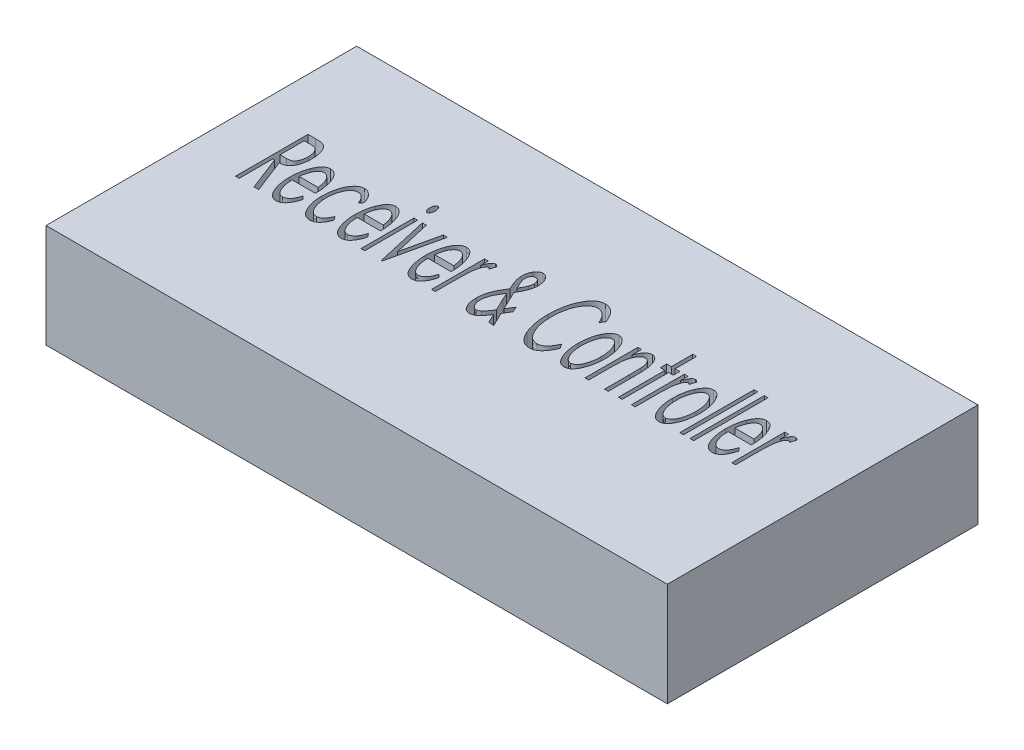
from build123d import *

# Parameters (mm, degrees)
SKETCH1_W           = 30
SKETCH1_H           = 15
BOSS_EXTRUDE1_DEPTH = 5
SKETCH2_W           = 0.17948718
SKETCH2_H           = 2.557692308
SKETCH2_H_2         = 3.58974359
SKETCH2_W_2         = 0.179487179
CUT_EXTRUDE1_DEPTH  = 2


with BuildPart() as part:
    # Sketch1 → Boss-Extrude1 (new body)
    with BuildSketch(Plane(origin=(0, 0, 0), x_dir=(1, 0, 0), z_dir=(0, 1, 0))):
        with Locations((-6.422413793, 0.797413793)):
            Rectangle(SKETCH1_W, SKETCH1_H)
    extrude(amount=BOSS_EXTRUDE1_DEPTH)

    # Sketch2 → Cut-Extrude1 (cut)
    # profile 1 of 20: a face of its own
    with BuildSketch(Plane(origin=(0, 5, 0), x_dir=(1, 0, 0), z_dir=(0, 1, 0))):
        with BuildLine():
            Line((-18.911387535, 3.436406349), (-18.553815419, 3.436406349))
            add(Edge.make_bspline(
                [(-18.553815419, 3.436406349), (-18.529977807, 3.436251717), (-18.48416207, 3.435954516), (-18.418424781, 3.434270932), (-18.358876699, 3.429549411), (-18.3052002, 3.425346538), (-18.257826305, 3.417923107), (-18.215992772, 3.410696665), (-18.180240678, 3.401204207), (-18.159018012, 3.392656812), (-18.149268144, 3.388730067)],
                knots=[0, 0, 0, 0, 1.396932602, 2.684895432, 3.851846456, 4.897053615, 5.838313078, 6.660226865, 7.384497111, 8, 8, 8, 8], degree=3))
            add(Edge.make_bspline(
                [(-18.149268144, 3.388730067), (-18.135974386, 3.382314282), (-18.109055075, 3.369322582), (-18.071954377, 3.342784463), (-18.036785644, 3.311519941), (-18.002669658, 3.275972194), (-17.972361496, 3.233642242), (-17.941776017, 3.187942169), (-17.914679856, 3.135918887), (-17.879619322, 3.059271373), (-17.841962336, 2.953289525), (-17.812186506, 2.814009367), (-17.792731208, 2.661747399), (-17.790666879, 2.555629434), (-17.789592663, 2.500408753)],
                knots=[0, 0, 0, 0, 0.52807617, 1.069332505, 1.627050354, 2.213510198, 2.829818747, 3.489432448, 4.182481638, 4.928166571, 6.509293787, 8.199563212, 10.02236404, 12, 12, 12, 12], degree=3))
            add(Edge.make_bspline(
                [(-17.789592663, 2.500408753), (-17.790271519, 2.453863554), (-17.791587897, 2.363607269), (-17.80540281, 2.232647014), (-17.826564033, 2.11011245), (-17.85719828, 1.996999533), (-17.895299171, 1.894687194), (-17.940458699, 1.804209019), (-17.99491689, 1.727857979), (-18.056645944, 1.663485608), (-18.129349107, 1.612660722), (-18.214856646, 1.577992055), (-18.311992535, 1.555903695), (-18.380975714, 1.55320438), (-18.417096669, 1.551790965)],
                knots=[0, 0, 0, 0, 1.30318405, 2.527017854, 3.683902417, 4.782720662, 5.80395304, 6.737809769, 7.606020839, 8.420689625, 9.225063989, 10.069965136, 10.989395644, 12, 12, 12, 12], degree=3))
            Line((-18.417096669, 1.551790965), (-17.789592663, -0.063593651))
            Line((-17.789592663, -0.063593651), (-18.016055003, -0.063593651))
            Line((-18.016055003, -0.063593651), (-18.642857887, 1.551790965))
            Line((-18.642857887, 1.551790965), (-18.731900355, 1.551790965))
            Line((-18.731900355, 1.551790965), (-18.731900355, -0.063593651))
            Line((-18.731900355, -0.063593651), (-18.911387535, -0.063593651))
            Line((-18.911387535, -0.063593651), (-18.911387535, 3.436406349))
        make_face()
        with BuildLine():
            Line((-18.731900355, 3.077431991), (-18.731900355, 1.910765324))
            Line((-18.731900355, 1.910765324), (-18.420602278, 1.905857471))
            add(Edge.make_bspline(
                [(-18.420602278, 1.905857471), (-18.392273993, 1.906594063), (-18.3395353, 1.907965374), (-18.266079886, 1.919629756), (-18.203930896, 1.939235735), (-18.152424016, 1.96922892), (-18.1101539, 2.008524904), (-18.073864004, 2.056910813), (-18.042665103, 2.114679659), (-18.016480211, 2.181435723), (-17.99513411, 2.254657777), (-17.97968857, 2.333245964), (-17.970484347, 2.415817639), (-17.969553594, 2.472340068), (-17.969079842, 2.501109875)],
                knots=[0, 0, 0, 0, 1.187938433, 2.211581827, 3.110816996, 3.906282281, 4.690548415, 5.516203012, 6.43338284, 7.43667608, 8.519609603, 9.629206102, 10.793270513, 12, 12, 12, 12], degree=3))
            add(Edge.make_bspline(
                [(-17.969079842, 2.501109875), (-17.969547217, 2.529180467), (-17.970465094, 2.584308352), (-17.979775291, 2.664995468), (-17.994995097, 2.741775857), (-18.016716934, 2.813484129), (-18.042516666, 2.878512497), (-18.072638708, 2.934874525), (-18.106884423, 2.981300538), (-18.14702523, 3.018263661), (-18.196066689, 3.046427563), (-18.257164097, 3.064196475), (-18.330613068, 3.076295332), (-18.384081945, 3.077034007), (-18.412889938, 3.077431991)],
                knots=[0, 0, 0, 0, 1.205235141, 2.36696338, 3.483174795, 4.562907058, 5.580668413, 6.483535164, 7.300634984, 8.046766767, 8.811241958, 9.706487552, 10.764300017, 12, 12, 12, 12], degree=3))
            Line((-18.412889938, 3.077431991), (-18.731900355, 3.077431991))
        make_face(mode=Mode.SUBTRACT)
    # profile 2 of 20: a face of its own
    with BuildSketch(Plane(origin=(0, 5, 0), x_dir=(1, 0, 0), z_dir=(0, 1, 0))):
        with BuildLine():
            Line((-16.448346669, 0.744098657), (-16.308823432, 0.597564202))
            add(Edge.make_bspline(
                [(-16.308823432, 0.597564202), (-16.320136037, 0.558420487), (-16.341772496, 0.483554313), (-16.378766515, 0.377709887), (-16.419066203, 0.283967841), (-16.462190426, 0.201833287), (-16.507059308, 0.129815592), (-16.555878037, 0.068139866), (-16.606195884, 0.013901335), (-16.660341878, -0.030587373), (-16.717637724, -0.065514325), (-16.778542924, -0.090722304), (-16.84329021, -0.105675597), (-16.887873456, -0.107529374), (-16.910385932, -0.108465445)],
                knots=[0, 0, 0, 0, 1.469774626, 2.811087318, 4.042166936, 5.147176912, 6.155303339, 7.098135502, 7.980804388, 8.819619538, 9.617788822, 10.392823073, 11.188450055, 12, 12, 12, 12], degree=3))
            add(Edge.make_bspline(
                [(-16.910385932, -0.108465445), (-16.935513782, -0.107290264), (-16.985106945, -0.104970888), (-17.056975759, -0.085330595), (-17.124174684, -0.052930902), (-17.187133403, -0.008064675), (-17.245637517, 0.049675656), (-17.299668265, 0.119925374), (-17.349394308, 0.202627061), (-17.393806777, 0.296482845), (-17.433923436, 0.397802409), (-17.468748637, 0.503988067), (-17.499375329, 0.613293499), (-17.522659907, 0.726341906), (-17.541597318, 0.842123908), (-17.556051809, 0.961133572), (-17.563397134, 1.083580493), (-17.564617258, 1.166399518), (-17.565233688, 1.208241285)],
                knots=[0, 0, 0, 0, 0.751038303, 1.482274219, 2.211198371, 2.973871351, 3.785035177, 4.662261782, 5.619491828, 6.667478129, 7.76628157, 8.878823215, 10.010633725, 11.161560532, 12.33097756, 13.521271466, 14.747698584, 16, 16, 16, 16], degree=3))
            add(Edge.make_bspline(
                [(-17.565233688, 1.208241285), (-17.564883777, 1.247514091), (-17.564191707, 1.325189719), (-17.557061742, 1.440066564), (-17.545019635, 1.551841218), (-17.528969831, 1.660384632), (-17.508874547, 1.765775735), (-17.483452545, 1.867772451), (-17.453573244, 1.966570468), (-17.429778985, 2.030536931), (-17.417998112, 2.062207632)],
                knots=[0, 0, 0, 0, 1.081354805, 2.138755058, 3.167849101, 4.176290871, 5.159507986, 6.121001866, 7.069681469, 8, 8, 8, 8], degree=3))
            add(Edge.make_bspline(
                [(-17.417998112, 2.062207632), (-17.402493487, 2.099642622), (-17.372860321, 2.171190128), (-17.320856652, 2.268985722), (-17.263411726, 2.351166782), (-17.203565962, 2.419867171), (-17.137877628, 2.472659473), (-17.068847341, 2.511706933), (-16.994488462, 2.534288361), (-16.943716762, 2.537400249), (-16.918098272, 2.538970452)],
                knots=[0, 0, 0, 0, 1.322197472, 2.527045748, 3.606318956, 4.589521203, 5.490186208, 6.34374623, 7.164284008, 8, 8, 8, 8], degree=3))
            add(Edge.make_bspline(
                [(-16.918098272, 2.538970452), (-16.891725921, 2.537594564), (-16.839267002, 2.534857697), (-16.763292423, 2.50920794), (-16.691576951, 2.469313256), (-16.624133442, 2.413497066), (-16.562323351, 2.341009924), (-16.504575956, 2.253293155), (-16.44949547, 2.150731081), (-16.419302713, 2.075174011), (-16.403474874, 2.035565003)],
                knots=[0, 0, 0, 0, 0.823440567, 1.637957963, 2.48296191, 3.382350809, 4.36252078, 5.454315555, 6.665485104, 8, 8, 8, 8], degree=3))
            add(Edge.make_bspline(
                [(-16.403474874, 2.035565003), (-16.392368766, 2.005067972), (-16.369769508, 1.943011102), (-16.341876833, 1.845552374), (-16.318240809, 1.74277649), (-16.298677496, 1.6344444), (-16.283048592, 1.52078935), (-16.273178383, 1.401408819), (-16.265707894, 1.276575009), (-16.264545313, 1.191426274), (-16.263951637, 1.147944811)],
                knots=[0, 0, 0, 0, 0.862103675, 1.754251248, 2.691108883, 3.663011642, 4.678144778, 5.737819903, 6.844810799, 8, 8, 8, 8], degree=3))
            Line((-16.263951637, 1.147944811), (-17.385746509, 1.147944811))
            add(Edge.make_bspline(
                [(-17.385746509, 1.147944811), (-17.385236446, 1.114268823), (-17.384236213, 1.048230133), (-17.375581473, 0.951742028), (-17.366107553, 0.859579994), (-17.350051392, 0.77268848), (-17.331777282, 0.689994044), (-17.307348376, 0.612631931), (-17.281242431, 0.538851162), (-17.249845906, 0.47105023), (-17.215769508, 0.409306603), (-17.179471739, 0.355282514), (-17.141644739, 0.308987183), (-17.101457451, 0.271304266), (-17.059022596, 0.241873914), (-17.014099638, 0.221438858), (-16.967477491, 0.208021968), (-16.935481422, 0.206431501), (-16.919500515, 0.205637119)],
                knots=[0, 0, 0, 0, 1.414313561, 2.773472163, 4.06801243, 5.30443612, 6.48331242, 7.623069609, 8.710148246, 9.768882371, 10.757758178, 11.669971891, 12.499622512, 13.26377558, 13.977242447, 14.658150177, 15.329793424, 16, 16, 16, 16], degree=3))
            add(Edge.make_bspline(
                [(-16.919500515, 0.205637119), (-16.903775909, 0.206266417), (-16.872156921, 0.207531808), (-16.825286481, 0.219405111), (-16.77942912, 0.238658127), (-16.734688466, 0.264910213), (-16.691341516, 0.296537892), (-16.652341731, 0.335189049), (-16.615461596, 0.377212706), (-16.581335554, 0.425933698), (-16.549062994, 0.485386439), (-16.516026013, 0.557832519), (-16.48153415, 0.645642669), (-16.459963261, 0.709636173), (-16.448346669, 0.744098657)],
                knots=[0, 0, 0, 0, 0.738465075, 1.484903234, 2.258522336, 3.071061432, 3.91960142, 4.774665461, 5.647350008, 6.546892649, 7.56535417, 8.824326256, 10.289801275, 12, 12, 12, 12], degree=3))
        make_face()
        with BuildLine():
            add(Edge.make_bspline(
                [(-16.443438817, 1.462047375), (-16.449191358, 1.50346176), (-16.460115186, 1.582105898), (-16.480640225, 1.693247767), (-16.505700315, 1.790947898), (-16.534571854, 1.8766095), (-16.567813295, 1.951988879), (-16.605548014, 2.019333897), (-16.649257372, 2.078379584), (-16.696749894, 2.129362721), (-16.746376034, 2.172400951), (-16.799853067, 2.201733338), (-16.854035136, 2.221963139), (-16.891284727, 2.223907458), (-16.90968481, 2.224867888)],
                knots=[0, 0, 0, 0, 1.557983534, 2.958543775, 4.20899479, 5.313354295, 6.323151934, 7.274795459, 8.184011725, 9.052834006, 9.869040623, 10.617635379, 11.317156976, 12, 12, 12, 12], degree=3))
            add(Edge.make_bspline(
                [(-16.90968481, 2.224867888), (-16.924707092, 2.22423936), (-16.954713332, 2.222983906), (-16.998731195, 2.211358929), (-17.040624123, 2.191586875), (-17.081905516, 2.165821223), (-17.119943931, 2.13079002), (-17.157108124, 2.089295825), (-17.192643513, 2.040460306), (-17.213613685, 2.003994726), (-17.224488496, 1.985084234)],
                knots=[0, 0, 0, 0, 0.865497469, 1.728786899, 2.60358039, 3.531120603, 4.52424669, 5.574483609, 6.742164244, 8, 8, 8, 8], degree=3))
            add(Edge.make_bspline(
                [(-17.224488496, 1.985084234), (-17.232424807, 1.969765027), (-17.248990138, 1.937789498), (-17.270246162, 1.885804122), (-17.290712682, 1.828761454), (-17.309647033, 1.766043176), (-17.326820365, 1.697660369), (-17.343153253, 1.624085339), (-17.35689401, 1.544913651), (-17.365275464, 1.490340194), (-17.369620708, 1.462047375)],
                knots=[0, 0, 0, 0, 0.758823364, 1.583879516, 2.4686208, 3.425043348, 4.465103222, 5.570473885, 6.74044733, 8, 8, 8, 8], degree=3))
            Line((-17.369620708, 1.462047375), (-16.443438817, 1.462047375))
        make_face(mode=Mode.SUBTRACT)
    # profile 3 of 20: a face of its own
    with BuildSketch(Plane(origin=(0, 5, 0), x_dir=(1, 0, 0), z_dir=(0, 1, 0))):
        with BuildLine():
            Line((-14.693438817, 1.939511317), (-14.824548592, 1.776149939))
            add(Edge.make_bspline(
                [(-14.824548592, 1.776149939), (-14.838372378, 1.81149903), (-14.86469149, 1.878800182), (-14.912592179, 1.970306233), (-14.963561283, 2.04825965), (-15.018361169, 2.112636433), (-15.077765445, 2.162671051), (-15.141303346, 2.198739408), (-15.209189615, 2.220904387), (-15.256046048, 2.223542878), (-15.279576637, 2.224867888)],
                knots=[0, 0, 0, 0, 1.336305163, 2.544192086, 3.631120701, 4.611658069, 5.511896897, 6.352361613, 7.172581028, 8, 8, 8, 8], degree=3))
            add(Edge.make_bspline(
                [(-15.279576637, 2.224867888), (-15.298574544, 2.223822757), (-15.336104793, 2.221758107), (-15.391168476, 2.208296202), (-15.442790018, 2.18425801), (-15.492714291, 2.152393769), (-15.539684351, 2.110506304), (-15.583642707, 2.059338136), (-15.626255601, 2.000080361), (-15.664460099, 1.931704692), (-15.700089089, 1.857329093), (-15.730818131, 1.778040359), (-15.756630573, 1.694797048), (-15.778686579, 1.608093482), (-15.79440004, 1.517070449), (-15.806200686, 1.422318356), (-15.814449207, 1.323603226), (-15.814969418, 1.256402199), (-15.815233688, 1.222263721)],
                knots=[0, 0, 0, 0, 0.734590559, 1.451179226, 2.175022376, 2.92691271, 3.733541601, 4.597964661, 5.530664107, 6.550497731, 7.621481218, 8.717144549, 9.834498983, 10.98936278, 12.173302961, 13.402707303, 14.68056156, 16, 16, 16, 16], degree=3))
            add(Edge.make_bspline(
                [(-15.815233688, 1.222263721), (-15.814520179, 1.177588472), (-15.813112282, 1.089435217), (-15.799080722, 0.959225206), (-15.777794214, 0.83282658), (-15.747300189, 0.712074431), (-15.709263927, 0.599907513), (-15.664988599, 0.499211445), (-15.613630884, 0.411950484), (-15.556345472, 0.338323611), (-15.493479684, 0.279409053), (-15.425666101, 0.236594747), (-15.353363071, 0.210717478), (-15.303610381, 0.207324139), (-15.278875515, 0.205637119)],
                knots=[0, 0, 0, 0, 1.28229361, 2.530223252, 3.755853476, 4.960192552, 6.101845785, 7.153133164, 8.112912773, 9.001611845, 9.823147208, 10.573558126, 11.290835352, 12, 12, 12, 12], degree=3))
            add(Edge.make_bspline(
                [(-15.278875515, 0.205637119), (-15.256034912, 0.206949633), (-15.210528518, 0.209564615), (-15.144412362, 0.232098772), (-15.081865089, 0.268024714), (-15.022530781, 0.317834697), (-14.967790073, 0.382423766), (-14.916092928, 0.460279014), (-14.866825024, 0.551745338), (-14.839110756, 0.619011034), (-14.824548592, 0.654355067)],
                knots=[0, 0, 0, 0, 0.806205515, 1.606240619, 2.443024153, 3.347030114, 4.33167063, 5.427740812, 6.648434187, 8, 8, 8, 8], degree=3))
            Line((-14.824548592, 0.654355067), (-14.693438817, 0.481879106))
            add(Edge.make_bspline(
                [(-14.693438817, 0.481879106), (-14.709126153, 0.437345343), (-14.739199548, 0.351971927), (-14.797059677, 0.234448595), (-14.863021963, 0.132568131), (-14.936384545, 0.046435957), (-15.016295192, -0.022753821), (-15.102717802, -0.072542439), (-15.195333852, -0.102830483), (-15.259258017, -0.106576358), (-15.291495708, -0.108465445)],
                knots=[0, 0, 0, 0, 1.259863082, 2.415219589, 3.488309116, 4.492742025, 5.426787631, 6.29598591, 7.140646142, 8, 8, 8, 8], degree=3))
            add(Edge.make_bspline(
                [(-15.291495708, -0.108465445), (-15.316397951, -0.107554514), (-15.365731902, -0.105749863), (-15.437541674, -0.086085151), (-15.50637068, -0.056707631), (-15.571515245, -0.014481406), (-15.632844747, 0.039788181), (-15.691202566, 0.105457564), (-15.745731931, 0.183449519), (-15.796901873, 0.271717006), (-15.843475983, 0.368554851), (-15.883853476, 0.4715477), (-15.918493125, 0.579454101), (-15.946412017, 0.692616869), (-15.968027154, 0.810882966), (-15.983112006, 0.934271108), (-15.993571007, 1.062461415), (-15.994333156, 1.149792628), (-15.994720868, 1.194218849)],
                knots=[0, 0, 0, 0, 0.736844345, 1.459765773, 2.192457744, 2.95003968, 3.750787605, 4.61482809, 5.549547464, 6.568405485, 7.637992768, 8.733390638, 9.846994005, 10.996916682, 12.187910264, 13.410496659, 14.682694954, 16, 16, 16, 16], degree=3))
            add(Edge.make_bspline(
                [(-15.994720868, 1.194218849), (-15.993726551, 1.254091158), (-15.991768443, 1.371997701), (-15.97380829, 1.545655004), (-15.944440809, 1.712700526), (-15.904396952, 1.871540735), (-15.854076874, 2.018644278), (-15.794108534, 2.150446696), (-15.725262174, 2.265295697), (-15.660015357, 2.348013304), (-15.604081739, 2.4044054), (-15.561220616, 2.4400914), (-15.517477501, 2.471047961), (-15.471691982, 2.4951081), (-15.425572487, 2.515431777), (-15.37757901, 2.528516302), (-15.328752447, 2.537395663), (-15.29550829, 2.538445297), (-15.278875515, 2.538970452)],
                knots=[0, 0, 0, 0, 1.727705212, 3.402370046, 5.032618855, 6.619588756, 8.125676606, 9.514098103, 10.791272457, 11.981705352, 12.544545066, 13.080890971, 13.589856437, 14.087841108, 14.571455574, 15.041229159, 15.520306095, 16, 16, 16, 16], degree=3))
            add(Edge.make_bspline(
                [(-15.278875515, 2.538970452), (-15.257749025, 2.538047241), (-15.21544943, 2.536198782), (-15.15319501, 2.520447061), (-15.091816132, 2.496556038), (-15.032938656, 2.461824264), (-14.976644566, 2.419852662), (-14.923526091, 2.372175949), (-14.875934696, 2.317615226), (-14.83199809, 2.25736745), (-14.791679886, 2.190119297), (-14.75542368, 2.114369032), (-14.721625135, 2.030369872), (-14.703055538, 1.970510803), (-14.693438817, 1.939511317)],
                knots=[0, 0, 0, 0, 0.846871262, 1.695611082, 2.563170208, 3.483594697, 4.429251307, 5.378994048, 6.342719227, 7.329724403, 8.369065968, 9.485130971, 10.697613466, 12, 12, 12, 12], degree=3))
        make_face()
    # profile 4 of 20: a face of its own
    with BuildSketch(Plane(origin=(0, 5, 0), x_dir=(1, 0, 0), z_dir=(0, 1, 0))):
        with BuildLine():
            Line((-13.307321028, 0.744098657), (-13.167797791, 0.597564202))
            add(Edge.make_bspline(
                [(-13.167797791, 0.597564202), (-13.179110396, 0.558420487), (-13.200746855, 0.483554313), (-13.237740874, 0.377709887), (-13.278040562, 0.283967841), (-13.321164785, 0.201833287), (-13.366033667, 0.129815592), (-13.414852396, 0.068139866), (-13.465170242, 0.013901335), (-13.519316237, -0.030587373), (-13.576612083, -0.065514325), (-13.637517283, -0.090722304), (-13.702264569, -0.105675597), (-13.746847815, -0.107529374), (-13.769360291, -0.108465445)],
                knots=[0, 0, 0, 0, 1.469774626, 2.811087318, 4.042166936, 5.147176912, 6.155303339, 7.098135502, 7.980804388, 8.819619538, 9.617788822, 10.392823073, 11.188450055, 12, 12, 12, 12], degree=3))
            add(Edge.make_bspline(
                [(-13.769360291, -0.108465445), (-13.794488141, -0.107290264), (-13.844081304, -0.104970888), (-13.915950118, -0.085330595), (-13.983149043, -0.052930902), (-14.046107762, -0.008064675), (-14.104611876, 0.049675656), (-14.158642624, 0.119925374), (-14.208368667, 0.202627061), (-14.252781136, 0.296482845), (-14.292897795, 0.397802409), (-14.327722996, 0.503988067), (-14.358349688, 0.613293499), (-14.381634266, 0.726341906), (-14.400571677, 0.842123908), (-14.415026168, 0.961133572), (-14.422371493, 1.083580493), (-14.423591617, 1.166399518), (-14.424208047, 1.208241285)],
                knots=[0, 0, 0, 0, 0.751038303, 1.482274219, 2.211198371, 2.973871351, 3.785035177, 4.662261782, 5.619491828, 6.667478129, 7.76628157, 8.878823215, 10.010633725, 11.161560532, 12.33097756, 13.521271466, 14.747698584, 16, 16, 16, 16], degree=3))
            add(Edge.make_bspline(
                [(-14.424208047, 1.208241285), (-14.423858136, 1.247514091), (-14.423166065, 1.325189719), (-14.416036101, 1.440066564), (-14.403993994, 1.551841218), (-14.38794419, 1.660384632), (-14.367848905, 1.765775735), (-14.342426904, 1.867772451), (-14.312547603, 1.966570468), (-14.288753344, 2.030536931), (-14.276972471, 2.062207632)],
                knots=[0, 0, 0, 0, 1.081354805, 2.138755058, 3.167849101, 4.176290871, 5.159507986, 6.121001866, 7.069681469, 8, 8, 8, 8], degree=3))
            add(Edge.make_bspline(
                [(-14.276972471, 2.062207632), (-14.261467846, 2.099642622), (-14.23183468, 2.171190128), (-14.179831011, 2.268985722), (-14.122386085, 2.351166782), (-14.062540321, 2.419867171), (-13.996851987, 2.472659473), (-13.9278217, 2.511706933), (-13.853462821, 2.534288361), (-13.802691121, 2.537400249), (-13.777072631, 2.538970452)],
                knots=[0, 0, 0, 0, 1.322197472, 2.527045748, 3.606318956, 4.589521203, 5.490186208, 6.34374623, 7.164284008, 8, 8, 8, 8], degree=3))
            add(Edge.make_bspline(
                [(-13.777072631, 2.538970452), (-13.75070028, 2.537594564), (-13.698241361, 2.534857697), (-13.622266782, 2.50920794), (-13.55055131, 2.469313256), (-13.483107801, 2.413497066), (-13.42129771, 2.341009924), (-13.363550315, 2.253293155), (-13.308469829, 2.150731081), (-13.278277072, 2.075174011), (-13.262449233, 2.035565003)],
                knots=[0, 0, 0, 0, 0.823440567, 1.637957963, 2.48296191, 3.382350809, 4.36252078, 5.454315555, 6.665485104, 8, 8, 8, 8], degree=3))
            add(Edge.make_bspline(
                [(-13.262449233, 2.035565003), (-13.251343125, 2.005067972), (-13.228743867, 1.943011102), (-13.200851192, 1.845552374), (-13.177215168, 1.74277649), (-13.157651855, 1.6344444), (-13.142022951, 1.52078935), (-13.132152742, 1.401408819), (-13.124682253, 1.276575009), (-13.123519672, 1.191426274), (-13.122925996, 1.147944811)],
                knots=[0, 0, 0, 0, 0.862103675, 1.754251248, 2.691108883, 3.663011642, 4.678144778, 5.737819903, 6.844810799, 8, 8, 8, 8], degree=3))
            Line((-13.122925996, 1.147944811), (-14.244720868, 1.147944811))
            add(Edge.make_bspline(
                [(-14.244720868, 1.147944811), (-14.244210805, 1.114268823), (-14.243210572, 1.048230133), (-14.234555832, 0.951742028), (-14.225081912, 0.859579994), (-14.209025751, 0.77268848), (-14.190751641, 0.689994044), (-14.166322735, 0.612631931), (-14.14021679, 0.538851162), (-14.108820265, 0.47105023), (-14.074743867, 0.409306603), (-14.038446098, 0.355282514), (-14.000619098, 0.308987183), (-13.96043181, 0.271304266), (-13.917996955, 0.241873914), (-13.873073997, 0.221438858), (-13.82645185, 0.208021968), (-13.794455781, 0.206431501), (-13.778474874, 0.205637119)],
                knots=[0, 0, 0, 0, 1.414313561, 2.773472163, 4.06801243, 5.30443612, 6.48331242, 7.623069609, 8.710148246, 9.768882371, 10.757758178, 11.669971891, 12.499622512, 13.26377558, 13.977242447, 14.658150177, 15.329793424, 16, 16, 16, 16], degree=3))
            add(Edge.make_bspline(
                [(-13.778474874, 0.205637119), (-13.762750268, 0.206266417), (-13.73113128, 0.207531808), (-13.68426084, 0.219405111), (-13.638403479, 0.238658127), (-13.593662825, 0.264910213), (-13.550315875, 0.296537892), (-13.51131609, 0.335189049), (-13.474435955, 0.377212706), (-13.440309913, 0.425933698), (-13.408037353, 0.485386439), (-13.375000372, 0.557832519), (-13.340508509, 0.645642669), (-13.31893762, 0.709636173), (-13.307321028, 0.744098657)],
                knots=[0, 0, 0, 0, 0.738465075, 1.484903234, 2.258522336, 3.071061432, 3.91960142, 4.774665461, 5.647350008, 6.546892649, 7.56535417, 8.824326256, 10.289801275, 12, 12, 12, 12], degree=3))
        make_face()
        with BuildLine():
            add(Edge.make_bspline(
                [(-13.302413176, 1.462047375), (-13.308165717, 1.50346176), (-13.319089545, 1.582105898), (-13.339614584, 1.693247767), (-13.364674674, 1.790947898), (-13.393546213, 1.8766095), (-13.426787654, 1.951988879), (-13.464522373, 2.019333897), (-13.508231731, 2.078379584), (-13.555724253, 2.129362721), (-13.605350393, 2.172400951), (-13.658827426, 2.201733338), (-13.713009495, 2.221963139), (-13.750259086, 2.223907458), (-13.768659169, 2.224867888)],
                knots=[0, 0, 0, 0, 1.557983534, 2.958543775, 4.20899479, 5.313354295, 6.323151934, 7.274795459, 8.184011725, 9.052834006, 9.869040623, 10.617635379, 11.317156976, 12, 12, 12, 12], degree=3))
            add(Edge.make_bspline(
                [(-13.768659169, 2.224867888), (-13.783681451, 2.22423936), (-13.813687691, 2.222983906), (-13.857705554, 2.211358929), (-13.899598482, 2.191586875), (-13.940879875, 2.165821223), (-13.97891829, 2.13079002), (-14.016082483, 2.089295825), (-14.051617872, 2.040460306), (-14.072588044, 2.003994726), (-14.083462855, 1.985084234)],
                knots=[0, 0, 0, 0, 0.865497469, 1.728786899, 2.60358039, 3.531120603, 4.52424669, 5.574483609, 6.742164244, 8, 8, 8, 8], degree=3))
            add(Edge.make_bspline(
                [(-14.083462855, 1.985084234), (-14.091399166, 1.969765027), (-14.107964497, 1.937789498), (-14.129220521, 1.885804122), (-14.149687041, 1.828761454), (-14.168621392, 1.766043176), (-14.185794724, 1.697660369), (-14.202127612, 1.624085339), (-14.215868369, 1.544913651), (-14.224249823, 1.490340194), (-14.228595067, 1.462047375)],
                knots=[0, 0, 0, 0, 0.758823364, 1.583879516, 2.4686208, 3.425043348, 4.465103222, 5.570473885, 6.74044733, 8, 8, 8, 8], degree=3))
            Line((-14.228595067, 1.462047375), (-13.302413176, 1.462047375))
        make_face(mode=Mode.SUBTRACT)
    # profile 5 of 20: a face of its own
    with BuildSketch(Plane(origin=(0, 5, 0), x_dir=(1, 0, 0), z_dir=(0, 1, 0))):
        with BuildLine():
            add(Edge.make_bspline(
                [(-12.764652759, 3.571021734), (-12.755316816, 3.570091277), (-12.736363735, 3.568202339), (-12.710302465, 3.551147965), (-12.687460118, 3.525375163), (-12.667849015, 3.490618628), (-12.650410349, 3.449844377), (-12.6379572, 3.403598726), (-12.631174267, 3.353172791), (-12.629963577, 3.318404224), (-12.629336253, 3.300388721)],
                knots=[0, 0, 0, 0, 0.678032738, 1.376487587, 2.212177249, 3.186510094, 4.283014321, 5.453655413, 6.680599126, 8, 8, 8, 8], degree=3))
            add(Edge.make_bspline(
                [(-12.629336253, 3.300388721), (-12.629974399, 3.282841726), (-12.631213342, 3.248774743), (-12.637931969, 3.199263839), (-12.650545814, 3.153543113), (-12.667838222, 3.112960271), (-12.687462446, 3.078207421), (-12.71030199, 3.052433832), (-12.736363841, 3.035379621), (-12.755316851, 3.033490662), (-12.764652759, 3.032560196)],
                knots=[0, 0, 0, 0, 1.296180038, 2.516495969, 3.680475243, 4.78632659, 5.768965108, 6.611778583, 7.31618739, 8, 8, 8, 8], degree=3))
            add(Edge.make_bspline(
                [(-12.764652759, 3.032560196), (-12.773733265, 3.033536512), (-12.792405958, 3.03554416), (-12.818330446, 3.05220944), (-12.840233474, 3.078698692), (-12.861136154, 3.112513027), (-12.877071308, 3.1537783), (-12.890060384, 3.199221181), (-12.896665575, 3.248786407), (-12.897920595, 3.282845691), (-12.898567022, 3.300388721)],
                knots=[0, 0, 0, 0, 0.669029318, 1.375758044, 2.209744962, 3.204550074, 4.30740338, 5.475216135, 6.699551088, 8, 8, 8, 8], degree=3))
            add(Edge.make_bspline(
                [(-12.898567022, 3.300388721), (-12.897931095, 3.318400104), (-12.896703805, 3.35316072), (-12.890036943, 3.403642248), (-12.877201598, 3.449606784), (-12.861124774, 3.491065607), (-12.840235882, 3.524883935), (-12.818329952, 3.551372347), (-12.792406066, 3.568037801), (-12.7737333, 3.570045428), (-12.764652759, 3.571021734)],
                knots=[0, 0, 0, 0, 1.323709376, 2.554659673, 3.729123491, 4.822624578, 5.808993721, 6.635908413, 7.336644065, 8, 8, 8, 8], degree=3))
        make_face()
    # profile 6 of 20: a face of its own
    with BuildSketch(Plane(origin=(0, 5, 0), x_dir=(1, 0, 0), z_dir=(0, 1, 0))):
        with Locations((-12.763951637, 1.215252503)):
            Rectangle(SKETCH2_W, SKETCH2_H)
    # profile 7 of 20: a face of its own
    with BuildSketch(Plane(origin=(0, 5, 0), x_dir=(1, 0, 0), z_dir=(0, 1, 0))):
        Polygon((-12.449849073, 2.494098657), (-12.253534971, 2.494098657), (-11.844079842, 0.701330228), (-11.435325836, 2.494098657), (-11.238310612, 2.494098657), (-11.821643945, -0.063593651), (-11.86651574, -0.063593651), align=None)
    # profile 8 of 20: a face of its own
    with BuildSketch(Plane(origin=(0, 5, 0), x_dir=(1, 0, 0), z_dir=(0, 1, 0))):
        with BuildLine():
            Line((-9.897064618, 0.744098657), (-9.757541381, 0.597564202))
            add(Edge.make_bspline(
                [(-9.757541381, 0.597564202), (-9.768853985, 0.558420487), (-9.790490445, 0.483554313), (-9.827484464, 0.377709887), (-9.867784152, 0.283967841), (-9.910908375, 0.201833287), (-9.955777257, 0.129815592), (-10.004595986, 0.068139866), (-10.054913832, 0.013901335), (-10.109059826, -0.030587373), (-10.166355673, -0.065514325), (-10.227260873, -0.090722304), (-10.292008158, -0.105675597), (-10.336591405, -0.107529374), (-10.359103881, -0.108465445)],
                knots=[0, 0, 0, 0, 1.469774626, 2.811087318, 4.042166936, 5.147176912, 6.155303339, 7.098135502, 7.980804388, 8.819619538, 9.617788822, 10.392823073, 11.188450055, 12, 12, 12, 12], degree=3))
            add(Edge.make_bspline(
                [(-10.359103881, -0.108465445), (-10.384231731, -0.107290264), (-10.433824893, -0.104970888), (-10.505693708, -0.085330595), (-10.572892633, -0.052930902), (-10.635851352, -0.008064675), (-10.694355465, 0.049675656), (-10.748386214, 0.119925374), (-10.798112257, 0.202627061), (-10.842524726, 0.296482845), (-10.882641384, 0.397802409), (-10.917466586, 0.503988067), (-10.948093278, 0.613293499), (-10.971377856, 0.726341906), (-10.990315266, 0.842123908), (-11.004769757, 0.961133572), (-11.012115083, 1.083580493), (-11.013335207, 1.166399518), (-11.013951637, 1.208241285)],
                knots=[0, 0, 0, 0, 0.751038303, 1.482274219, 2.211198371, 2.973871351, 3.785035177, 4.662261782, 5.619491828, 6.667478129, 7.76628157, 8.878823215, 10.010633725, 11.161560532, 12.33097756, 13.521271466, 14.747698584, 16, 16, 16, 16], degree=3))
            add(Edge.make_bspline(
                [(-11.013951637, 1.208241285), (-11.013601726, 1.247514091), (-11.012909655, 1.325189719), (-11.005779691, 1.440066564), (-10.993737584, 1.551841218), (-10.97768778, 1.660384632), (-10.957592495, 1.765775735), (-10.932170494, 1.867772451), (-10.902291192, 1.966570468), (-10.878496934, 2.030536931), (-10.86671606, 2.062207632)],
                knots=[0, 0, 0, 0, 1.081354805, 2.138755058, 3.167849101, 4.176290871, 5.159507986, 6.121001866, 7.069681469, 8, 8, 8, 8], degree=3))
            add(Edge.make_bspline(
                [(-10.86671606, 2.062207632), (-10.851211435, 2.099642622), (-10.82157827, 2.171190128), (-10.7695746, 2.268985722), (-10.712129675, 2.351166782), (-10.65228391, 2.419867171), (-10.586595577, 2.472659473), (-10.51756529, 2.511706933), (-10.443206411, 2.534288361), (-10.392434711, 2.537400249), (-10.366816221, 2.538970452)],
                knots=[0, 0, 0, 0, 1.322197472, 2.527045748, 3.606318956, 4.589521203, 5.490186208, 6.34374623, 7.164284008, 8, 8, 8, 8], degree=3))
            add(Edge.make_bspline(
                [(-10.366816221, 2.538970452), (-10.34044387, 2.537594564), (-10.28798495, 2.534857697), (-10.212010372, 2.50920794), (-10.1402949, 2.469313256), (-10.07285139, 2.413497066), (-10.0110413, 2.341009924), (-9.953293904, 2.253293155), (-9.898213418, 2.150731081), (-9.868020662, 2.075174011), (-9.852192823, 2.035565003)],
                knots=[0, 0, 0, 0, 0.823440567, 1.637957963, 2.48296191, 3.382350809, 4.36252078, 5.454315555, 6.665485104, 8, 8, 8, 8], degree=3))
            add(Edge.make_bspline(
                [(-9.852192823, 2.035565003), (-9.841086715, 2.005067972), (-9.818487457, 1.943011102), (-9.790594781, 1.845552374), (-9.766958758, 1.74277649), (-9.747395445, 1.6344444), (-9.731766541, 1.52078935), (-9.721896331, 1.401408819), (-9.714425843, 1.276575009), (-9.713263262, 1.191426274), (-9.712669586, 1.147944811)],
                knots=[0, 0, 0, 0, 0.862103675, 1.754251248, 2.691108883, 3.663011642, 4.678144778, 5.737819903, 6.844810799, 8, 8, 8, 8], degree=3))
            Line((-9.712669586, 1.147944811), (-10.834464458, 1.147944811))
            add(Edge.make_bspline(
                [(-10.834464458, 1.147944811), (-10.833954395, 1.114268823), (-10.832954161, 1.048230133), (-10.824299422, 0.951742028), (-10.814825502, 0.859579994), (-10.798769341, 0.77268848), (-10.780495231, 0.689994044), (-10.756066325, 0.612631931), (-10.72996038, 0.538851162), (-10.698563855, 0.47105023), (-10.664487457, 0.409306603), (-10.628189687, 0.355282514), (-10.590362688, 0.308987183), (-10.5501754, 0.271304266), (-10.507740545, 0.241873914), (-10.462817587, 0.221438858), (-10.41619544, 0.208021968), (-10.38419937, 0.206431501), (-10.368218464, 0.205637119)],
                knots=[0, 0, 0, 0, 1.414313561, 2.773472163, 4.06801243, 5.30443612, 6.48331242, 7.623069609, 8.710148246, 9.768882371, 10.757758178, 11.669971891, 12.499622512, 13.26377558, 13.977242447, 14.658150177, 15.329793424, 16, 16, 16, 16], degree=3))
            add(Edge.make_bspline(
                [(-10.368218464, 0.205637119), (-10.352493858, 0.206266417), (-10.32087487, 0.207531808), (-10.274004429, 0.219405111), (-10.228147069, 0.238658127), (-10.183406414, 0.264910213), (-10.140059464, 0.296537892), (-10.101059679, 0.335189049), (-10.064179545, 0.377212706), (-10.030053503, 0.425933698), (-9.997780943, 0.485386439), (-9.964743962, 0.557832519), (-9.930252098, 0.645642669), (-9.90868121, 0.709636173), (-9.897064618, 0.744098657)],
                knots=[0, 0, 0, 0, 0.738465075, 1.484903234, 2.258522336, 3.071061432, 3.91960142, 4.774665461, 5.647350008, 6.546892649, 7.56535417, 8.824326256, 10.289801275, 12, 12, 12, 12], degree=3))
        make_face()
        with BuildLine():
            add(Edge.make_bspline(
                [(-9.892156765, 1.462047375), (-9.897909306, 1.50346176), (-9.908833134, 1.582105898), (-9.929358174, 1.693247767), (-9.954418264, 1.790947898), (-9.983289803, 1.8766095), (-10.016531243, 1.951988879), (-10.054265963, 2.019333897), (-10.097975321, 2.078379584), (-10.145467842, 2.129362721), (-10.195093983, 2.172400951), (-10.248571016, 2.201733338), (-10.302753085, 2.221963139), (-10.340002676, 2.223907458), (-10.358402759, 2.224867888)],
                knots=[0, 0, 0, 0, 1.557983534, 2.958543775, 4.20899479, 5.313354295, 6.323151934, 7.274795459, 8.184011725, 9.052834006, 9.869040623, 10.617635379, 11.317156976, 12, 12, 12, 12], degree=3))
            add(Edge.make_bspline(
                [(-10.358402759, 2.224867888), (-10.373425041, 2.22423936), (-10.403431281, 2.222983906), (-10.447449144, 2.211358929), (-10.489342072, 2.191586875), (-10.530623464, 2.165821223), (-10.56866188, 2.13079002), (-10.605826073, 2.089295825), (-10.641361462, 2.040460306), (-10.662331634, 2.003994726), (-10.673206445, 1.985084234)],
                knots=[0, 0, 0, 0, 0.865497469, 1.728786899, 2.60358039, 3.531120603, 4.52424669, 5.574483609, 6.742164244, 8, 8, 8, 8], degree=3))
            add(Edge.make_bspline(
                [(-10.673206445, 1.985084234), (-10.681142756, 1.969765027), (-10.697708086, 1.937789498), (-10.71896411, 1.885804122), (-10.73943063, 1.828761454), (-10.758364982, 1.766043176), (-10.775538314, 1.697660369), (-10.791871201, 1.624085339), (-10.805611959, 1.544913651), (-10.813993413, 1.490340194), (-10.818338656, 1.462047375)],
                knots=[0, 0, 0, 0, 0.758823364, 1.583879516, 2.4686208, 3.425043348, 4.465103222, 5.570473885, 6.74044733, 8, 8, 8, 8], degree=3))
            Line((-10.818338656, 1.462047375), (-9.892156765, 1.462047375))
        make_face(mode=Mode.SUBTRACT)
    # profile 9 of 20: a face of its own
    with BuildSketch(Plane(origin=(0, 5, 0), x_dir=(1, 0, 0), z_dir=(0, 1, 0))):
        with BuildLine():
            Line((-9.443438817, 2.494098657), (-9.263951637, 2.494098657))
            Line((-9.263951637, 2.494098657), (-9.263951637, 2.117596253))
            add(Edge.make_bspline(
                [(-9.263951637, 2.117596253), (-9.252531823, 2.15236687), (-9.2311401, 2.217499572), (-9.193966367, 2.305689793), (-9.157126981, 2.379126863), (-9.118823372, 2.437854856), (-9.078152454, 2.481868037), (-9.038250275, 2.515162717), (-8.99542011, 2.534852703), (-8.966145077, 2.537625965), (-8.951952438, 2.538970452)],
                knots=[0, 0, 0, 0, 1.585633559, 2.970226224, 4.143554047, 5.143681873, 5.996763239, 6.732369705, 7.385448357, 8, 8, 8, 8], degree=3))
            add(Edge.make_bspline(
                [(-8.951952438, 2.538970452), (-8.941033219, 2.537708368), (-8.917666371, 2.535007541), (-8.883258137, 2.516948049), (-8.847958631, 2.489140916), (-8.826734649, 2.464618539), (-8.815233688, 2.451330228)],
                knots=[0, 0, 0, 0, 0.783612691, 1.676910978, 2.741152627, 4, 4, 4, 4], degree=3))
            Line((-8.815233688, 2.451330228), (-8.901471669, 2.179294971))
            add(Edge.make_bspline(
                [(-8.901471669, 2.179294971), (-8.909082037, 2.185967802), (-8.92313189, 2.198286825), (-8.943805652, 2.213354327), (-8.963346456, 2.222888047), (-8.97617895, 2.224242745), (-8.982100676, 2.224867888)],
                knots=[0, 0, 0, 0, 1.284577118, 2.371517395, 3.248515015, 4, 4, 4, 4], degree=3))
            add(Edge.make_bspline(
                [(-8.982100676, 2.224867888), (-8.995109215, 2.223070783), (-9.022990728, 2.219219006), (-9.060607523, 2.189607387), (-9.096775568, 2.146616676), (-9.132378781, 2.086733058), (-9.165021513, 2.009486264), (-9.192902056, 1.913824503), (-9.218256578, 1.800310092), (-9.229762021, 1.717834255), (-9.235906765, 1.673786157)],
                knots=[0, 0, 0, 0, 0.485134988, 1.039801416, 1.736123207, 2.59795597, 3.638971913, 4.876325678, 6.331730643, 8, 8, 8, 8], degree=3))
            add(Edge.make_bspline(
                [(-9.235906765, 1.673786157), (-9.238129206, 1.65346469), (-9.243078071, 1.608213433), (-9.248330792, 1.533138104), (-9.253154807, 1.444084608), (-9.257458196, 1.341251634), (-9.259932628, 1.224608225), (-9.262066827, 1.094198311), (-9.263435176, 0.949763617), (-9.263774253, 0.848799776), (-9.263951637, 0.79598167)],
                knots=[0, 0, 0, 0, 0.558358783, 1.243337199, 2.055316671, 2.994523906, 4.05455052, 5.24210095, 6.557235908, 8, 8, 8, 8], degree=3))
            Line((-9.263951637, 0.79598167), (-9.263951637, -0.063593651))
            Line((-9.263951637, -0.063593651), (-9.443438817, -0.063593651))
            Line((-9.443438817, -0.063593651), (-9.443438817, 2.494098657))
        make_face()
    # profile 10 of 20: a face of its own
    with BuildSketch(Plane(origin=(0, 5, 0), x_dir=(1, 0, 0), z_dir=(0, 1, 0))):
        with BuildLine():
            Line((-6.658583047, 1.237688401), (-6.541495708, 0.964952023))
            add(Edge.make_bspline(
                [(-6.541495708, 0.964952023), (-6.579092648, 0.903468652), (-6.651610641, 0.784877868), (-6.724462676, 0.666492005), (-6.759544586, 0.609483273)],
                knots=[0, 0, 0, 0, 1.036899648, 2, 2, 2, 2], degree=3))
            add(Edge.make_bspline(
                [(-6.759544586, 0.609483273), (-6.748795465, 0.587046713), (-6.725174333, 0.537742505), (-6.686433578, 0.456964947), (-6.641717316, 0.362128257), (-6.609308757, 0.294427826), (-6.591976477, 0.258221253)],
                knots=[0, 0, 0, 0, 0.767098967, 1.68569549, 2.762296886, 4, 4, 4, 4], degree=3))
            add(Edge.make_bspline(
                [(-6.591976477, 0.258221253), (-6.577699763, 0.228784058), (-6.550058431, 0.171790322), (-6.510165018, 0.088677403), (-6.471972574, 0.011236513), (-6.448397271, -0.039248352), (-6.43702856, -0.063593651)],
                knots=[0, 0, 0, 0, 1.099165264, 2.128108185, 3.097318288, 4, 4, 4, 4], degree=3))
            Line((-6.43702856, -0.063593651), (-6.684524554, -0.063593651))
            Line((-6.684524554, -0.063593651), (-6.898366701, 0.383722055))
            add(Edge.make_bspline(
                [(-6.898366701, 0.383722055), (-6.914513495, 0.357409886), (-6.945545693, 0.30684106), (-6.993752324, 0.236022017), (-7.039017328, 0.171510625), (-7.082385625, 0.113689155), (-7.124402935, 0.063253964), (-7.164558228, 0.019421866), (-7.202525466, -0.017888471), (-7.251022865, -0.05668396), (-7.310880411, -0.095930429), (-7.386347282, -0.12784726), (-7.463125496, -0.150218476), (-7.515664357, -0.152295999), (-7.541996509, -0.15333724)],
                knots=[0, 0, 0, 0, 1.265380351, 2.431908972, 3.511133349, 4.496038593, 5.393972168, 6.200859742, 6.932640963, 7.573045838, 8.745069577, 9.852129705, 10.923500727, 12, 12, 12, 12], degree=3))
            add(Edge.make_bspline(
                [(-7.541996509, -0.15333724), (-7.559120734, -0.152732745), (-7.593049558, -0.151535037), (-7.642251549, -0.13990853), (-7.688730366, -0.121329178), (-7.732525182, -0.095655711), (-7.774354221, -0.063220205), (-7.81277116, -0.022698388), (-7.848913629, 0.024692124), (-7.880953579, 0.079302397), (-7.911331411, 0.13852159), (-7.936848116, 0.202259355), (-7.958948245, 0.269398959), (-7.976113304, 0.340297218), (-7.990055395, 0.414722427), (-8.000966775, 0.492815382), (-8.006111021, 0.574590417), (-8.0070596, 0.630278151), (-8.007541381, 0.658561798)],
                knots=[0, 0, 0, 0, 0.795539121, 1.576229473, 2.337369759, 3.116847858, 3.930240072, 4.79142142, 5.706894284, 6.6969923, 7.732663132, 8.800699435, 9.887170435, 11.018414644, 12.191215338, 13.409012617, 14.684044601, 16, 16, 16, 16], degree=3))
            add(Edge.make_bspline(
                [(-8.007541381, 0.658561798), (-8.006721338, 0.702319378), (-8.005075652, 0.790133415), (-7.987702774, 0.921760354), (-7.962169864, 1.053547213), (-7.931646978, 1.163710614), (-7.900248693, 1.253817014), (-7.87025801, 1.326024047), (-7.83614341, 1.403171616), (-7.79616016, 1.484338053), (-7.750131874, 1.569447122), (-7.698881151, 1.659180429), (-7.642398031, 1.753443027), (-7.601969729, 1.817138263), (-7.581259329, 1.849767728)],
                knots=[0, 0, 0, 0, 1.225459279, 2.459288803, 3.714055988, 4.985122622, 5.658235603, 6.386670464, 7.175262146, 8.021663707, 8.92114706, 9.886115549, 10.917110262, 12, 12, 12, 12], degree=3))
            add(Edge.make_bspline(
                [(-7.581259329, 1.849767728), (-7.593627282, 1.877586426), (-7.617514913, 1.931315833), (-7.652298894, 2.008758797), (-7.682020968, 2.081356725), (-7.709740542, 2.147396452), (-7.732750588, 2.208400581), (-7.753344968, 2.263076718), (-7.769416018, 2.312821278), (-7.787209505, 2.370640682), (-7.803430387, 2.439139617), (-7.817445623, 2.518735399), (-7.826394002, 2.59649261), (-7.827505168, 2.647621599), (-7.828054201, 2.672884715)],
                knots=[0, 0, 0, 0, 1.265295084, 2.443807891, 3.527922166, 4.525380546, 5.420079281, 6.237468416, 6.953135134, 7.59227344, 8.751333377, 9.875520144, 10.950282781, 12, 12, 12, 12], degree=3))
            add(Edge.make_bspline(
                [(-7.828054201, 2.672884715), (-7.827157512, 2.714608872), (-7.825437772, 2.794630705), (-7.803669522, 2.908503107), (-7.773561272, 3.012754024), (-7.739466037, 3.073724354), (-7.722885932, 3.103373497)],
                knots=[0, 0, 0, 0, 1.114274756, 2.137042787, 3.094066153, 4, 4, 4, 4], degree=3))
            add(Edge.make_bspline(
                [(-7.722885932, 3.103373497), (-7.712601177, 3.11895514), (-7.692704856, 3.149098526), (-7.660110515, 3.190209014), (-7.624452097, 3.223947435), (-7.588000922, 3.252618847), (-7.549020532, 3.274729272), (-7.507990073, 3.289860918), (-7.465424143, 3.300645668), (-7.436195433, 3.30140612), (-7.42140356, 3.301790965)],
                knots=[0, 0, 0, 0, 1.184839774, 2.292125685, 3.320181637, 4.293267994, 5.229716497, 6.149811737, 7.063668972, 8, 8, 8, 8], degree=3))
            add(Edge.make_bspline(
                [(-7.42140356, 3.301790965), (-7.402592053, 3.300677346), (-7.365201838, 3.298463891), (-7.3107127, 3.281564261), (-7.25928646, 3.253383341), (-7.211599977, 3.214549973), (-7.167004975, 3.167496444), (-7.128780488, 3.111571264), (-7.095485095, 3.048573215), (-7.068849488, 2.978696252), (-7.047304378, 2.90456595), (-7.032065695, 2.827365857), (-7.021555824, 2.748194743), (-7.020762407, 2.694420634), (-7.020361894, 2.667275741)],
                knots=[0, 0, 0, 0, 0.818541129, 1.626952433, 2.46061293, 3.35896595, 4.295284597, 5.275306947, 6.3000018, 7.392787292, 8.526950939, 9.659056419, 10.818303718, 12, 12, 12, 12], degree=3))
            add(Edge.make_bspline(
                [(-7.020361894, 2.667275741), (-7.020952929, 2.637786911), (-7.02216312, 2.577406294), (-7.035123089, 2.485861852), (-7.053864752, 2.391103491), (-7.081820139, 2.291813075), (-7.121623598, 2.184230217), (-7.17571079, 2.065153684), (-7.243643698, 1.931809103), (-7.29704853, 1.840148969), (-7.325349874, 1.791574619)],
                knots=[0, 0, 0, 0, 0.753353309, 1.542548076, 2.359192558, 3.221686746, 4.176172293, 5.288674749, 6.56316092, 8, 8, 8, 8], degree=3))
            Line((-7.325349874, 1.791574619), (-7.061026958, 1.237688401))
            Line((-7.061026958, 1.237688401), (-6.884344265, 0.869599458))
            add(Edge.make_bspline(
                [(-6.884344265, 0.869599458), (-6.863049863, 0.90440533), (-6.822051026, 0.971418258), (-6.763577871, 1.067963107), (-6.709393101, 1.15571636), (-6.674949734, 1.211283968), (-6.658583047, 1.237688401)],
                knots=[0, 0, 0, 0, 1.133921938, 2.18317847, 3.136688724, 4, 4, 4, 4], degree=3))
        make_face()
        with BuildLine():
            add(Edge.make_bspline(
                [(-7.432621509, 2.051690805), (-7.412604818, 2.083010255), (-7.373377866, 2.144387361), (-7.322355217, 2.238311622), (-7.278864749, 2.331482487), (-7.255528922, 2.394371839), (-7.244019746, 2.425388721)],
                knots=[0, 0, 0, 0, 1.062626184, 2.082441453, 3.054264588, 4, 4, 4, 4], degree=3))
            add(Edge.make_bspline(
                [(-7.244019746, 2.425388721), (-7.237048508, 2.446306968), (-7.223563198, 2.486771664), (-7.211069167, 2.546833488), (-7.201524645, 2.602941093), (-7.200395948, 2.6391938), (-7.199849073, 2.656758914)],
                knots=[0, 0, 0, 0, 1.117620544, 2.161948723, 3.109429816, 4, 4, 4, 4], degree=3))
            add(Edge.make_bspline(
                [(-7.199849073, 2.656758914), (-7.200752595, 2.675503424), (-7.202519802, 2.712166022), (-7.213565641, 2.765416211), (-7.233593166, 2.814389826), (-7.260701195, 2.858344655), (-7.29379461, 2.895814995), (-7.333234296, 2.92355832), (-7.378648353, 2.939586726), (-7.410527052, 2.941715665), (-7.427012535, 2.942816606)],
                knots=[0, 0, 0, 0, 1.106412553, 2.164044757, 3.191019711, 4.212888769, 5.199047838, 6.121012455, 7.028316198, 8, 8, 8, 8], degree=3))
            add(Edge.make_bspline(
                [(-7.427012535, 2.942816606), (-7.442822381, 2.941764091), (-7.473687938, 2.939709266), (-7.517553082, 2.922547299), (-7.556054876, 2.894319002), (-7.58872515, 2.856073443), (-7.614520946, 2.810779933), (-7.635049247, 2.761027443), (-7.645852524, 2.706526201), (-7.647648884, 2.668952166), (-7.648567022, 2.649747696)],
                knots=[0, 0, 0, 0, 0.928330017, 1.812378351, 2.728806209, 3.713725182, 4.749598858, 5.786842074, 6.868832506, 8, 8, 8, 8], degree=3))
            add(Edge.make_bspline(
                [(-7.648567022, 2.649747696), (-7.647450246, 2.619870215), (-7.645268256, 2.561494705), (-7.629110998, 2.505371395), (-7.621223272, 2.477972856)],
                knots=[0, 0, 0, 0, 1.023630663, 2, 2, 2, 2], degree=3))
            add(Edge.make_bspline(
                [(-7.621223272, 2.477972856), (-7.609083055, 2.444691707), (-7.584016373, 2.375973991), (-7.540390768, 2.27160191), (-7.489765877, 2.162663168), (-7.452050007, 2.089420269), (-7.432621509, 2.051690805)],
                knots=[0, 0, 0, 0, 0.911100302, 1.881207026, 2.908550529, 4, 4, 4, 4], degree=3))
        make_face(mode=Mode.SUBTRACT)
        with BuildLine():
            add(Edge.make_bspline(
                [(-7.466976477, 1.586847055), (-7.484887844, 1.559363281), (-7.519586534, 1.506120504), (-7.56746839, 1.42737057), (-7.612522262, 1.354049629), (-7.650400097, 1.28372473), (-7.68526881, 1.218656421), (-7.714728226, 1.157607381), (-7.739516979, 1.100847664), (-7.765171616, 1.031645002), (-7.79029811, 0.949821449), (-7.811097806, 0.854554324), (-7.82568559, 0.763243133), (-7.827277567, 0.703252487), (-7.828054201, 0.673986478)],
                knots=[0, 0, 0, 0, 1.18550137, 2.296605466, 3.330860636, 4.294817972, 5.182689411, 5.998669535, 6.743960998, 7.420143741, 8.665228194, 9.833300343, 10.942990984, 12, 12, 12, 12], degree=3))
            add(Edge.make_bspline(
                [(-7.828054201, 0.673986478), (-7.826969274, 0.641199678), (-7.824847695, 0.577084955), (-7.808450524, 0.48372384), (-7.781238483, 0.396079676), (-7.743260176, 0.316879173), (-7.698822008, 0.249013904), (-7.646853475, 0.198161619), (-7.587796444, 0.166724935), (-7.545836763, 0.162732025), (-7.525169586, 0.160765324)],
                knots=[0, 0, 0, 0, 1.208397699, 2.363026728, 3.483183371, 4.581684834, 5.592710229, 6.458314798, 7.240645297, 8, 8, 8, 8], degree=3))
            add(Edge.make_bspline(
                [(-7.525169586, 0.160765324), (-7.509149533, 0.161685461), (-7.476380379, 0.163567609), (-7.428266559, 0.180346042), (-7.380318934, 0.20568743), (-7.35159283, 0.229592209), (-7.336567823, 0.242095452)],
                knots=[0, 0, 0, 0, 0.913597457, 1.868771333, 2.885274353, 4, 4, 4, 4], degree=3))
            add(Edge.make_bspline(
                [(-7.336567823, 0.242095452), (-7.311308814, 0.266175065), (-7.257090471, 0.317861839), (-7.181020406, 0.410811484), (-7.101637262, 0.520513572), (-7.050742442, 0.601220866), (-7.023867503, 0.643838241)],
                knots=[0, 0, 0, 0, 0.819326677, 1.758680793, 2.816474499, 4, 4, 4, 4], degree=3))
            Line((-7.023867503, 0.643838241), (-7.307821829, 1.236286157))
            add(Edge.make_bspline(
                [(-7.307821829, 1.236286157), (-7.319990478, 1.262220176), (-7.345395356, 1.316363463), (-7.384519228, 1.400583611), (-7.425347558, 1.491534213), (-7.452777237, 1.554336725), (-7.466976477, 1.586847055)],
                knots=[0, 0, 0, 0, 0.892858571, 1.864049613, 2.894304562, 4, 4, 4, 4], degree=3))
        make_face(mode=Mode.SUBTRACT)
    # profile 11 of 20: a face of its own
    with BuildSketch(Plane(origin=(0, 5, 0), x_dir=(1, 0, 0), z_dir=(0, 1, 0))):
        with BuildLine():
            Line((-3.879336253, 2.794178785), (-4.016756124, 2.583842247))
            add(Edge.make_bspline(
                [(-4.016756124, 2.583842247), (-4.03611483, 2.629055177), (-4.073143058, 2.715535893), (-4.137912191, 2.834219868), (-4.209874386, 2.934895266), (-4.287013127, 3.018558303), (-4.369135605, 3.084918425), (-4.456233975, 3.13220652), (-4.54766427, 3.162200723), (-4.610618296, 3.165515137), (-4.642156765, 3.16717558)],
                knots=[0, 0, 0, 0, 1.299185471, 2.485007972, 3.564697683, 4.560911303, 5.483881321, 6.340461428, 7.168610648, 8, 8, 8, 8], degree=3))
            add(Edge.make_bspline(
                [(-4.642156765, 3.16717558), (-4.659503939, 3.166758742), (-4.694250326, 3.165923816), (-4.745441542, 3.155314299), (-4.795863149, 3.139989201), (-4.845211093, 3.117932955), (-4.893444635, 3.089736304), (-4.941098953, 3.055742773), (-4.986939828, 3.014929184), (-5.047946392, 2.951920976), (-5.118805703, 2.86026578), (-5.192187104, 2.733942188), (-5.257005672, 2.591537211), (-5.30993587, 2.432742358), (-5.352380371, 2.260621845), (-5.383014012, 2.077358025), (-5.401412121, 1.883564911), (-5.403768249, 1.750950686), (-5.404977278, 1.682900741)],
                knots=[0, 0, 0, 0, 0.45774643, 0.916866041, 1.375985651, 1.848859789, 2.34149154, 2.850576784, 3.393287444, 3.961145049, 5.167050785, 6.443546623, 7.814561503, 9.295151989, 10.860649304, 12.495527756, 14.201707638, 16, 16, 16, 16], degree=3))
            add(Edge.make_bspline(
                [(-5.404977278, 1.682900741), (-5.404356692, 1.631230373), (-5.403142256, 1.530115816), (-5.392101357, 1.381808888), (-5.375824486, 1.240139547), (-5.35181901, 1.104841542), (-5.321285394, 0.975966297), (-5.283372953, 0.85343378), (-5.238469534, 0.737777971), (-5.187930877, 0.6294621), (-5.131560838, 0.531253801), (-5.071862605, 0.444410302), (-5.007453261, 0.371345123), (-4.940060448, 0.310932614), (-4.868445868, 0.263468814), (-4.79264026, 0.230716093), (-4.713501273, 0.208700965), (-4.659131645, 0.206666058), (-4.631639938, 0.205637119)],
                knots=[0, 0, 0, 0, 1.361066875, 2.663493237, 3.915974716, 5.116529894, 6.281377342, 7.403118823, 8.492786024, 9.54768219, 10.548887674, 11.472965329, 12.319202403, 13.108680678, 13.851549293, 14.571113617, 15.277491369, 16, 16, 16, 16], degree=3))
            add(Edge.make_bspline(
                [(-4.631639938, 0.205637119), (-4.601510606, 0.20737039), (-4.541163792, 0.210842004), (-4.453205233, 0.240043747), (-4.369361311, 0.286406468), (-4.290177466, 0.351942331), (-4.215039914, 0.435167366), (-4.143673793, 0.536293477), (-4.076349282, 0.655616761), (-4.037282675, 0.743037473), (-4.016756124, 0.788970452)],
                knots=[0, 0, 0, 0, 0.803819289, 1.609990315, 2.451669169, 3.353266404, 4.343836988, 5.441246616, 6.655568437, 8, 8, 8, 8], degree=3))
            Line((-4.016756124, 0.788970452), (-3.879336253, 0.580737279))
            add(Edge.make_bspline(
                [(-3.879336253, 0.580737279), (-3.890309668, 0.552357292), (-3.911887985, 0.496550389), (-3.947692081, 0.416435817), (-3.984544956, 0.340661904), (-4.025119949, 0.270819847), (-4.065705403, 0.204438574), (-4.11036771, 0.144393584), (-4.155847342, 0.088586729), (-4.203415206, 0.03794877), (-4.253009693, -0.006685524), (-4.303909312, -0.045963124), (-4.356503656, -0.07860409), (-4.410087766, -0.106660534), (-4.465672872, -0.127700568), (-4.522856451, -0.142241336), (-4.581295692, -0.151949312), (-4.620850537, -0.152872628), (-4.640754522, -0.15333724)],
                knots=[0, 0, 0, 0, 1.296200491, 2.548871353, 3.737868192, 4.884022115, 5.989127934, 7.050667326, 8.069356663, 9.055503585, 10.007320038, 10.90950695, 11.790846336, 12.641442791, 13.482897822, 14.316123122, 15.152673735, 16, 16, 16, 16], degree=3))
            add(Edge.make_bspline(
                [(-4.640754522, -0.15333724), (-4.678111186, -0.151478294), (-4.751861957, -0.147808301), (-4.859002764, -0.117528698), (-4.959848585, -0.069263459), (-5.054372687, -0.001273499), (-5.141514849, 0.086621538), (-5.22289643, 0.192763908), (-5.298304849, 0.318030425), (-5.340697631, 0.410363025), (-5.362909971, 0.458742087)],
                knots=[0, 0, 0, 0, 0.889987636, 1.757043257, 2.634913996, 3.546251599, 4.520108944, 5.577402331, 6.730643314, 8, 8, 8, 8], degree=3))
            add(Edge.make_bspline(
                [(-5.362909971, 0.458742087), (-5.380811409, 0.502690865), (-5.417149453, 0.591902276), (-5.461039518, 0.731874706), (-5.500344324, 0.877854846), (-5.530325447, 1.030968512), (-5.555524274, 1.190376431), (-5.571478016, 1.356628118), (-5.582631217, 1.52943645), (-5.58384565, 1.646890741), (-5.584464458, 1.706738882)],
                knots=[0, 0, 0, 0, 0.892200441, 1.811073353, 2.756806339, 3.734396212, 4.744014794, 5.791127521, 6.874482058, 8, 8, 8, 8], degree=3))
            add(Edge.make_bspline(
                [(-5.584464458, 1.706738882), (-5.583689248, 1.769627871), (-5.582168906, 1.892965764), (-5.569284869, 2.074090165), (-5.548473307, 2.247523175), (-5.519241631, 2.413326959), (-5.481027572, 2.571440093), (-5.436239751, 2.722455154), (-5.380959643, 2.865370024), (-5.318714765, 2.99952589), (-5.250391789, 3.122052882), (-5.176961511, 3.229574359), (-5.098544602, 3.320299896), (-5.016600737, 3.395681948), (-4.929516406, 3.454360553), (-4.837732752, 3.49548866), (-4.741712721, 3.521295141), (-4.675969113, 3.524523834), (-4.642857887, 3.526149939)],
                knots=[0, 0, 0, 0, 1.350883623, 2.649353136, 3.89856053, 5.102044923, 6.263763384, 7.391449509, 8.483282176, 9.552439238, 10.566269587, 11.493781365, 12.344403006, 13.137041638, 13.879228367, 14.589340494, 15.289532994, 16, 16, 16, 16], degree=3))
            add(Edge.make_bspline(
                [(-4.642857887, 3.526149939), (-4.62272398, 3.525669437), (-4.582711772, 3.524714534), (-4.523466576, 3.515231729), (-4.465927674, 3.499842335), (-4.410018551, 3.478252112), (-4.354920808, 3.452129403), (-4.302429972, 3.417468339), (-4.250448147, 3.378634056), (-4.200635205, 3.333194141), (-4.152371803, 3.283041782), (-4.106702593, 3.227278814), (-4.063641411, 3.166649945), (-4.020718413, 3.102489056), (-3.983091255, 3.031760183), (-3.945324687, 2.957333612), (-3.910457293, 2.877743854), (-3.889819557, 2.822328169), (-3.879336253, 2.794178785)],
                knots=[0, 0, 0, 0, 0.856532349, 1.702190794, 2.54685376, 3.387581895, 4.250790716, 5.136691882, 6.059960502, 7.01095472, 8.003107282, 9.020916617, 10.075690141, 11.16844244, 12.303884376, 13.482947173, 14.721418249, 16, 16, 16, 16], degree=3))
        make_face()
    # profile 12 of 20: a face of its own
    with BuildSketch(Plane(origin=(0, 5, 0), x_dir=(1, 0, 0), z_dir=(0, 1, 0))):
        with BuildLine():
            add(Edge.make_bspline(
                [(-3.003635131, 2.538970452), (-2.979872373, 2.537906178), (-2.932608294, 2.535789339), (-2.864175579, 2.514002575), (-2.799338659, 2.480144347), (-2.736816561, 2.434084593), (-2.678902064, 2.373446414), (-2.624059181, 2.300269141), (-2.572048721, 2.21423678), (-2.541956083, 2.150846963), (-2.526171188, 2.117596253)],
                knots=[0, 0, 0, 0, 0.843577701, 1.677874383, 2.529941952, 3.44009667, 4.428447994, 5.503311921, 6.690378774, 8, 8, 8, 8], degree=3))
            add(Edge.make_bspline(
                [(-2.526171188, 2.117596253), (-2.512160997, 2.085055622), (-2.483795585, 2.019172978), (-2.449325092, 1.916106366), (-2.419854726, 1.808870926), (-2.394830483, 1.697381821), (-2.377640438, 1.581039581), (-2.36274687, 1.460739871), (-2.355533739, 1.335934303), (-2.354314461, 1.251249935), (-2.353695227, 1.208241285)],
                knots=[0, 0, 0, 0, 0.911590579, 1.845630971, 2.79426017, 3.773633235, 4.784390523, 5.820063118, 6.892875455, 8, 8, 8, 8], degree=3))
            add(Edge.make_bspline(
                [(-2.353695227, 1.208241285), (-2.354242693, 1.164994785), (-2.355320934, 1.07982025), (-2.363577985, 0.954100358), (-2.378844397, 0.832566852), (-2.397613862, 0.71484155), (-2.424370714, 0.601606666), (-2.454383355, 0.492136933), (-2.492170617, 0.387248365), (-2.534128283, 0.287583454), (-2.579988651, 0.195583709), (-2.630750789, 0.115238873), (-2.683692878, 0.046261488), (-2.74103896, -0.009936201), (-2.801557132, -0.054157515), (-2.865736408, -0.085789678), (-2.933616318, -0.104769575), (-2.980146543, -0.107225625), (-3.003635131, -0.108465445)],
                knots=[0, 0, 0, 0, 1.301298947, 2.562924903, 3.788461415, 4.986201962, 6.14793309, 7.287790237, 8.39993342, 9.49971249, 10.540722194, 11.488924044, 12.355509222, 13.151197152, 13.89676473, 14.601269901, 15.293917145, 16, 16, 16, 16], degree=3))
            add(Edge.make_bspline(
                [(-3.003635131, -0.108465445), (-3.027117729, -0.107200963), (-3.073861755, -0.104683907), (-3.142039494, -0.08593479), (-3.206431044, -0.054166255), (-3.266985455, -0.009745582), (-3.324965427, 0.046211101), (-3.378672528, 0.11502351), (-3.429363018, 0.195606607), (-3.475179419, 0.287600532), (-3.517478629, 0.387077342), (-3.55378527, 0.492437206), (-3.585598691, 0.601336087), (-3.610434138, 0.715061771), (-3.631115873, 0.832405329), (-3.644739297, 0.954177062), (-3.653445248, 1.079807329), (-3.654461358, 1.164990434), (-3.654977278, 1.208241285)],
                knots=[0, 0, 0, 0, 0.705440217, 1.4042363, 2.108100269, 2.852989273, 3.652997896, 4.523145192, 5.47048404, 6.510546275, 7.609324387, 8.718120464, 9.858867499, 11.017987859, 12.215813406, 13.439407729, 14.699885423, 16, 16, 16, 16], degree=3))
            add(Edge.make_bspline(
                [(-3.654977278, 1.208241285), (-3.654362765, 1.251017576), (-3.65314953, 1.335470824), (-3.645828218, 1.460022498), (-3.631404237, 1.580204015), (-3.612698645, 1.695815397), (-3.588862844, 1.807281463), (-3.559553627, 1.914308121), (-3.524725014, 2.017249716), (-3.496490169, 2.082944596), (-3.482501317, 2.115492888)],
                knots=[0, 0, 0, 0, 1.103600926, 2.178839769, 3.216854868, 4.224898256, 5.199312966, 6.155900535, 7.086347569, 8, 8, 8, 8], degree=3))
            add(Edge.make_bspline(
                [(-3.482501317, 2.115492888), (-3.46674624, 2.14899325), (-3.436791298, 2.212687093), (-3.384440291, 2.299135325), (-3.329331888, 2.372579625), (-3.270948197, 2.433017546), (-3.209369826, 2.480642562), (-3.143706028, 2.513921491), (-3.074890179, 2.535742002), (-3.02739915, 2.537893743), (-3.003635131, 2.538970452)],
                knots=[0, 0, 0, 0, 1.3116991, 2.493918051, 3.576000503, 4.560315464, 5.46508553, 6.321043193, 7.159867415, 8, 8, 8, 8], degree=3))
        make_face()
        with BuildLine():
            add(Edge.make_bspline(
                [(-3.004336253, 2.224867888), (-3.020338405, 2.223898253), (-3.052260313, 2.221963977), (-3.098831364, 2.206917616), (-3.143492958, 2.183557669), (-3.186126627, 2.150104022), (-3.227413915, 2.108144376), (-3.26580188, 2.055944551), (-3.303070786, 1.995209284), (-3.338185995, 1.926022737), (-3.369874952, 1.849891208), (-3.398824033, 1.769571129), (-3.42264034, 1.685217827), (-3.441329959, 1.59681944), (-3.456765284, 1.504678328), (-3.468058232, 1.408531125), (-3.474296299, 1.308586413), (-3.47508695, 1.240735021), (-3.475490099, 1.20613792)],
                knots=[0, 0, 0, 0, 0.633328474, 1.263395849, 1.922297409, 2.622747561, 3.402359392, 4.249154536, 5.185072166, 6.225072861, 7.321168891, 8.452296706, 9.607823688, 10.792618436, 12.032427099, 13.310317054, 14.628543482, 16, 16, 16, 16], degree=3))
            add(Edge.make_bspline(
                [(-3.475490099, 1.20613792), (-3.474653013, 1.161472853), (-3.473002122, 1.073384959), (-3.460814368, 0.943646286), (-3.441348483, 0.818551555), (-3.414380508, 0.699721333), (-3.380847195, 0.589479995), (-3.340199576, 0.491606877), (-3.295802456, 0.40585832), (-3.244688259, 0.334895767), (-3.189633025, 0.277686927), (-3.130514078, 0.236976648), (-3.06873189, 0.209768873), (-3.025630831, 0.207003422), (-3.004336253, 0.205637119)],
                knots=[0, 0, 0, 0, 1.343625255, 2.649881141, 3.916827948, 5.150040387, 6.313170605, 7.378672881, 8.334918638, 9.211145051, 10.001680462, 10.70963726, 11.362481287, 12, 12, 12, 12], degree=3))
            add(Edge.make_bspline(
                [(-3.004336253, 0.205637119), (-2.983039696, 0.207001367), (-2.939934636, 0.209762657), (-2.878183884, 0.237003113), (-2.819065513, 0.277480116), (-2.764679607, 0.335142013), (-2.713688131, 0.406021804), (-2.668164156, 0.491241763), (-2.628752234, 0.589684585), (-2.595116546, 0.699785565), (-2.567106434, 0.818452531), (-2.547921021, 0.943659387), (-2.53565393, 1.073381532), (-2.534013957, 1.1614717), (-2.533182406, 1.20613792)],
                knots=[0, 0, 0, 0, 0.63766136, 1.290651464, 1.99876667, 2.784553339, 3.660975812, 4.620765142, 5.683833951, 6.847224424, 8.082295646, 9.349525938, 10.656074103, 12, 12, 12, 12], degree=3))
            add(Edge.make_bspline(
                [(-2.533182406, 1.20613792), (-2.533587201, 1.240734683), (-2.534381078, 1.308585412), (-2.540595901, 1.408534902), (-2.551973016, 1.504664802), (-2.567117368, 1.596916976), (-2.586875605, 1.685147033), (-2.61076078, 1.7694025), (-2.638433678, 1.850215022), (-2.671383854, 1.925850511), (-2.706311914, 1.995178457), (-2.74343765, 2.056237979), (-2.782752289, 2.107660451), (-2.823221337, 2.150349314), (-2.865917729, 2.183522782), (-2.91053325, 2.206927235), (-2.956891725, 2.221885965), (-2.988571543, 2.223877065), (-3.004336253, 2.224867888)],
                knots=[0, 0, 0, 0, 1.372102031, 2.690948916, 3.969440344, 5.209832555, 6.397176509, 7.553247371, 8.681828641, 9.782077646, 10.822567844, 11.758925988, 12.611729478, 13.385237583, 14.08601742, 14.74522911, 15.375593043, 16, 16, 16, 16], degree=3))
        make_face(mode=Mode.SUBTRACT)
    # profile 13 of 20: a face of its own
    with BuildSketch(Plane(origin=(0, 5, 0), x_dir=(1, 0, 0), z_dir=(0, 1, 0))):
        with BuildLine():
            Line((-2.039592663, 2.494098657), (-1.860105483, 2.494098657))
            Line((-1.860105483, 2.494098657), (-1.860105483, 2.032760516))
            add(Edge.make_bspline(
                [(-1.860105483, 2.032760516), (-1.843863215, 2.074138722), (-1.813220022, 2.152204191), (-1.761216987, 2.258563426), (-1.705810113, 2.346804625), (-1.647533297, 2.417369885), (-1.586132076, 2.471738084), (-1.521841189, 2.510300887), (-1.454171534, 2.534383623), (-1.407833881, 2.537445026), (-1.384744906, 2.538970452)],
                knots=[0, 0, 0, 0, 1.44494997, 2.726089628, 3.843303477, 4.824976299, 5.692059493, 6.496121309, 7.250652256, 8, 8, 8, 8], degree=3))
            add(Edge.make_bspline(
                [(-1.384744906, 2.538970452), (-1.361593607, 2.537146325), (-1.314915036, 2.533468448), (-1.24747599, 2.504913125), (-1.185924661, 2.457512192), (-1.129368248, 2.393565226), (-1.079050315, 2.314586533), (-1.033720414, 2.223187398), (-0.998210882, 2.118199011), (-0.973370539, 2.022432305), (-0.956583979, 1.936782486), (-0.94669295, 1.862746378), (-0.937243154, 1.780272907), (-0.930702612, 1.689265562), (-0.925044472, 1.58969642), (-0.920990992, 1.481469858), (-0.917969691, 1.364842159), (-0.917856291, 1.284198334), (-0.917797791, 1.242596253)],
                knots=[0, 0, 0, 0, 0.743568692, 1.499212768, 2.316054105, 3.226782637, 4.232337739, 5.32220957, 6.502109852, 7.791896087, 8.504381504, 9.30960864, 10.195045147, 11.17573483, 12.245488089, 13.404685061, 14.661143592, 16, 16, 16, 16], degree=3))
            Line((-0.917797791, 1.242596253), (-0.917797791, -0.063593651))
            Line((-0.917797791, -0.063593651), (-1.097284971, -0.063593651))
            Line((-1.097284971, -0.063593651), (-1.097284971, 1.139531349))
            add(Edge.make_bspline(
                [(-1.097284971, 1.139531349), (-1.097217319, 1.174353943), (-1.097087918, 1.240961777), (-1.097965691, 1.33631341), (-1.098722522, 1.422783584), (-1.09909318, 1.500149818), (-1.100798254, 1.56838367), (-1.101869221, 1.627529638), (-1.104067975, 1.677536786), (-1.105680108, 1.707908476), (-1.106399554, 1.721462439)],
                knots=[0, 0, 0, 0, 1.435804352, 2.746372611, 3.931673093, 5.00134256, 5.936259494, 6.745935645, 7.44034915, 8, 8, 8, 8], degree=3))
            add(Edge.make_bspline(
                [(-1.106399554, 1.721462439), (-1.109372194, 1.760814746), (-1.114963429, 1.834832461), (-1.134285561, 1.937673705), (-1.161703579, 2.025323173), (-1.198151128, 2.097221756), (-1.241588268, 2.1543334), (-1.292821374, 2.19511713), (-1.350957396, 2.220922169), (-1.392430975, 2.223539055), (-1.4134909, 2.224867888)],
                knots=[0, 0, 0, 0, 1.455119256, 2.736932434, 3.852160231, 4.831667357, 5.697564978, 6.477261495, 7.226766556, 8, 8, 8, 8], degree=3))
            add(Edge.make_bspline(
                [(-1.4134909, 2.224867888), (-1.425935296, 2.224392922), (-1.450702352, 2.223447637), (-1.487215703, 2.2137278), (-1.522269219, 2.198089128), (-1.556800983, 2.176724045), (-1.589052733, 2.148101035), (-1.622177965, 2.115181686), (-1.652364527, 2.074646302), (-1.693248834, 2.013170216), (-1.738439793, 1.925828627), (-1.781434074, 1.8100776), (-1.815534924, 1.683072151), (-1.829195916, 1.593796535), (-1.836267342, 1.547584234)],
                knots=[0, 0, 0, 0, 0.521975724, 1.038845294, 1.575309178, 2.131197222, 2.737300406, 3.383154082, 4.090310456, 4.855692859, 6.485391403, 8.20723227, 10.036725669, 12, 12, 12, 12], degree=3))
            add(Edge.make_bspline(
                [(-1.836267342, 1.547584234), (-1.838242478, 1.530300007), (-1.842560193, 1.492516085), (-1.847110353, 1.431001751), (-1.851607849, 1.359734005), (-1.853782555, 1.278818361), (-1.856886993, 1.188157966), (-1.859089423, 1.087892307), (-1.859334705, 0.977805108), (-1.859841349, 0.90114962), (-1.860105483, 0.861185997)],
                knots=[0, 0, 0, 0, 0.60756689, 1.328162405, 2.154058795, 3.101506512, 4.155013957, 5.322551363, 6.604137138, 8, 8, 8, 8], degree=3))
            Line((-1.860105483, 0.861185997), (-1.860105483, -0.063593651))
            Line((-1.860105483, -0.063593651), (-2.039592663, -0.063593651))
            Line((-2.039592663, -0.063593651), (-2.039592663, 2.494098657))
        make_face()
    # profile 14 of 20: a face of its own
    with BuildSketch(Plane(origin=(0, 5, 0), x_dir=(1, 0, 0), z_dir=(0, 1, 0))):
        Polygon((-0.424208047, 3.526149939), (-0.244720868, 3.526149939), (-0.244720868, 2.494098657), (-0.020361894, 2.494098657), (-0.020361894, 2.179996093), (-0.244720868, 2.179996093), (-0.244720868, -0.063593651), (-0.424208047, -0.063593651), (-0.424208047, 2.179996093), (-0.648567022, 2.179996093), (-0.648567022, 2.494098657), (-0.424208047, 2.494098657), align=None)
    # profile 15 of 20: a face of its own
    with BuildSketch(Plane(origin=(0, 5, 0), x_dir=(1, 0, 0), z_dir=(0, 1, 0))):
        with BuildLine():
            Line((0.203997081, 2.494098657), (0.38348426, 2.494098657))
            Line((0.38348426, 2.494098657), (0.38348426, 2.117596253))
            add(Edge.make_bspline(
                [(0.38348426, 2.117596253), (0.394904075, 2.15236687), (0.416295797, 2.217499572), (0.453469531, 2.305689793), (0.490308917, 2.379126863), (0.528612526, 2.437854856), (0.569283444, 2.481868037), (0.609185622, 2.515162717), (0.652015788, 2.534852703), (0.68129082, 2.537625965), (0.695483459, 2.538970452)],
                knots=[0, 0, 0, 0, 1.585633559, 2.970226224, 4.143554047, 5.143681873, 5.996763239, 6.732369705, 7.385448357, 8, 8, 8, 8], degree=3))
            add(Edge.make_bspline(
                [(0.695483459, 2.538970452), (0.706402678, 2.537708368), (0.729769526, 2.535007541), (0.76417776, 2.516948049), (0.799477267, 2.489140916), (0.820701249, 2.464618539), (0.832202209, 2.451330228)],
                knots=[0, 0, 0, 0, 0.783612691, 1.676910978, 2.741152627, 4, 4, 4, 4], degree=3))
            Line((0.832202209, 2.451330228), (0.745964228, 2.179294971))
            add(Edge.make_bspline(
                [(0.745964228, 2.179294971), (0.73835386, 2.185967802), (0.724304007, 2.198286825), (0.703630246, 2.213354327), (0.684089441, 2.222888047), (0.671256947, 2.224242745), (0.665335222, 2.224867888)],
                knots=[0, 0, 0, 0, 1.284577118, 2.371517395, 3.248515015, 4, 4, 4, 4], degree=3))
            add(Edge.make_bspline(
                [(0.665335222, 2.224867888), (0.652326683, 2.223070783), (0.62444517, 2.219219006), (0.586828374, 2.189607387), (0.55066033, 2.146616676), (0.515057116, 2.086733058), (0.482414385, 2.009486264), (0.454533841, 1.913824503), (0.42917932, 1.800310092), (0.417673876, 1.717834255), (0.411529132, 1.673786157)],
                knots=[0, 0, 0, 0, 0.485134988, 1.039801416, 1.736123207, 2.59795597, 3.638971913, 4.876325678, 6.331730643, 8, 8, 8, 8], degree=3))
            add(Edge.make_bspline(
                [(0.411529132, 1.673786157), (0.409306692, 1.65346469), (0.404357826, 1.608213433), (0.399105105, 1.533138104), (0.394281091, 1.444084608), (0.389977701, 1.341251634), (0.387503269, 1.224608225), (0.38536907, 1.094198311), (0.384000721, 0.949763617), (0.383661645, 0.848799776), (0.38348426, 0.79598167)],
                knots=[0, 0, 0, 0, 0.558358783, 1.243337199, 2.055316671, 2.994523906, 4.05455052, 5.24210095, 6.557235908, 8, 8, 8, 8], degree=3))
            Line((0.38348426, 0.79598167), (0.38348426, -0.063593651))
            Line((0.38348426, -0.063593651), (0.203997081, -0.063593651))
            Line((0.203997081, -0.063593651), (0.203997081, 2.494098657))
        make_face()
    # profile 16 of 20: a face of its own
    with BuildSketch(Plane(origin=(0, 5, 0), x_dir=(1, 0, 0), z_dir=(0, 1, 0))):
        with BuildLine():
            add(Edge.make_bspline(
                [(1.573287946, 2.538970452), (1.597050704, 2.537906178), (1.644314783, 2.535789339), (1.712747497, 2.514002575), (1.777584418, 2.480144347), (1.840106516, 2.434084593), (1.898021013, 2.373446414), (1.952863896, 2.300269141), (2.004874356, 2.21423678), (2.034966994, 2.150846963), (2.050751888, 2.117596253)],
                knots=[0, 0, 0, 0, 0.843577701, 1.677874383, 2.529941952, 3.44009667, 4.428447994, 5.503311921, 6.690378774, 8, 8, 8, 8], degree=3))
            add(Edge.make_bspline(
                [(2.050751888, 2.117596253), (2.06476208, 2.085055622), (2.093127492, 2.019172978), (2.127597984, 1.916106366), (2.157068351, 1.808870926), (2.182092594, 1.697381821), (2.199282639, 1.581039581), (2.214176207, 1.460739871), (2.221389338, 1.335934303), (2.222608615, 1.251249935), (2.22322785, 1.208241285)],
                knots=[0, 0, 0, 0, 0.911590579, 1.845630971, 2.79426017, 3.773633235, 4.784390523, 5.820063118, 6.892875455, 8, 8, 8, 8], degree=3))
            add(Edge.make_bspline(
                [(2.22322785, 1.208241285), (2.222680384, 1.164994785), (2.221602143, 1.07982025), (2.213345092, 0.954100358), (2.19807868, 0.832566852), (2.179309215, 0.71484155), (2.152552363, 0.601606666), (2.122539722, 0.492136933), (2.08475246, 0.387248365), (2.042794793, 0.287583454), (1.996934426, 0.195583709), (1.946172288, 0.115238873), (1.893230199, 0.046261488), (1.835884117, -0.009936201), (1.775365945, -0.054157515), (1.711186669, -0.085789678), (1.643306759, -0.104769575), (1.596776534, -0.107225625), (1.573287946, -0.108465445)],
                knots=[0, 0, 0, 0, 1.301298947, 2.562924903, 3.788461415, 4.986201962, 6.14793309, 7.287790237, 8.39993342, 9.49971249, 10.540722194, 11.488924044, 12.355509222, 13.151197152, 13.89676473, 14.601269901, 15.293917145, 16, 16, 16, 16], degree=3))
            add(Edge.make_bspline(
                [(1.573287946, -0.108465445), (1.549805348, -0.107200963), (1.503061322, -0.104683907), (1.434883583, -0.08593479), (1.370492033, -0.054166255), (1.309937622, -0.009745582), (1.25195765, 0.046211101), (1.198250549, 0.11502351), (1.147560059, 0.195606607), (1.101743658, 0.287600532), (1.059444448, 0.387077342), (1.023137807, 0.492437206), (0.991324385, 0.601336087), (0.966488939, 0.715061771), (0.945807204, 0.832405329), (0.93218378, 0.954177062), (0.923477829, 1.079807329), (0.922461718, 1.164990434), (0.921945799, 1.208241285)],
                knots=[0, 0, 0, 0, 0.705440217, 1.4042363, 2.108100269, 2.852989273, 3.652997896, 4.523145192, 5.47048404, 6.510546275, 7.609324387, 8.718120464, 9.858867499, 11.017987859, 12.215813406, 13.439407729, 14.699885423, 16, 16, 16, 16], degree=3))
            add(Edge.make_bspline(
                [(0.921945799, 1.208241285), (0.922560312, 1.251017576), (0.923773547, 1.335470824), (0.931094859, 1.460022498), (0.94551884, 1.580204015), (0.964224432, 1.695815397), (0.988060233, 1.807281463), (1.017369449, 1.914308121), (1.052198063, 2.017249716), (1.080432908, 2.082944596), (1.09442176, 2.115492888)],
                knots=[0, 0, 0, 0, 1.103600926, 2.178839769, 3.216854868, 4.224898256, 5.199312966, 6.155900535, 7.086347569, 8, 8, 8, 8], degree=3))
            add(Edge.make_bspline(
                [(1.09442176, 2.115492888), (1.110176837, 2.14899325), (1.140131779, 2.212687093), (1.192482786, 2.299135325), (1.247591189, 2.372579625), (1.30597488, 2.433017546), (1.36755325, 2.480642562), (1.433217049, 2.513921491), (1.502032898, 2.535742002), (1.549523927, 2.537893743), (1.573287946, 2.538970452)],
                knots=[0, 0, 0, 0, 1.3116991, 2.493918051, 3.576000503, 4.560315464, 5.46508553, 6.321043193, 7.159867415, 8, 8, 8, 8], degree=3))
        make_face()
        with BuildLine():
            add(Edge.make_bspline(
                [(1.572586824, 2.224867888), (1.556584672, 2.223898253), (1.524662764, 2.221963977), (1.478091712, 2.206917616), (1.433430119, 2.183557669), (1.39079645, 2.150104022), (1.349509162, 2.108144376), (1.311121197, 2.055944551), (1.273852291, 1.995209284), (1.238737082, 1.926022737), (1.207048125, 1.849891208), (1.178099044, 1.769571129), (1.154282737, 1.685217827), (1.135593118, 1.59681944), (1.120157793, 1.504678328), (1.108864845, 1.408531125), (1.102626778, 1.308586413), (1.101836127, 1.240735021), (1.101432978, 1.20613792)],
                knots=[0, 0, 0, 0, 0.633328474, 1.263395849, 1.922297409, 2.622747561, 3.402359392, 4.249154536, 5.185072166, 6.225072861, 7.321168891, 8.452296706, 9.607823688, 10.792618436, 12.032427099, 13.310317054, 14.628543482, 16, 16, 16, 16], degree=3))
            add(Edge.make_bspline(
                [(1.101432978, 1.20613792), (1.102270064, 1.161472853), (1.103920955, 1.073384959), (1.116108709, 0.943646286), (1.135574594, 0.818551555), (1.162542569, 0.699721333), (1.196075882, 0.589479995), (1.236723501, 0.491606877), (1.281120621, 0.40585832), (1.332234818, 0.334895767), (1.387290052, 0.277686927), (1.446408999, 0.236976648), (1.508191187, 0.209768873), (1.551292246, 0.207003422), (1.572586824, 0.205637119)],
                knots=[0, 0, 0, 0, 1.343625255, 2.649881141, 3.916827948, 5.150040387, 6.313170605, 7.378672881, 8.334918638, 9.211145051, 10.001680462, 10.70963726, 11.362481287, 12, 12, 12, 12], degree=3))
            add(Edge.make_bspline(
                [(1.572586824, 0.205637119), (1.59388338, 0.207001367), (1.636988441, 0.209762657), (1.698739193, 0.237003113), (1.757857564, 0.277480116), (1.81224347, 0.335142013), (1.863234946, 0.406021804), (1.908758921, 0.491241763), (1.948170843, 0.589684585), (1.981806531, 0.699785565), (2.009816643, 0.818452531), (2.029002056, 0.943659387), (2.041269146, 1.073381532), (2.04290912, 1.1614717), (2.043740671, 1.20613792)],
                knots=[0, 0, 0, 0, 0.63766136, 1.290651464, 1.99876667, 2.784553339, 3.660975812, 4.620765142, 5.683833951, 6.847224424, 8.082295646, 9.349525938, 10.656074103, 12, 12, 12, 12], degree=3))
            add(Edge.make_bspline(
                [(2.043740671, 1.20613792), (2.043335876, 1.240734683), (2.042541999, 1.308585412), (2.036327175, 1.408534902), (2.024950061, 1.504664802), (2.009805709, 1.596916976), (1.990047472, 1.685147033), (1.966162297, 1.7694025), (1.938489399, 1.850215022), (1.905539223, 1.925850511), (1.870611163, 1.995178457), (1.833485427, 2.056237979), (1.794170788, 2.107660451), (1.75370174, 2.150349314), (1.711005348, 2.183522782), (1.666389827, 2.206927235), (1.620031352, 2.221885965), (1.588351534, 2.223877065), (1.572586824, 2.224867888)],
                knots=[0, 0, 0, 0, 1.372102031, 2.690948916, 3.969440344, 5.209832555, 6.397176509, 7.553247371, 8.681828641, 9.782077646, 10.822567844, 11.758925988, 12.611729478, 13.385237583, 14.08601742, 14.74522911, 15.375593043, 16, 16, 16, 16], degree=3))
        make_face(mode=Mode.SUBTRACT)
    # profile 17 of 20: a face of its own
    with BuildSketch(Plane(origin=(0, 5, 0), x_dir=(1, 0, 0), z_dir=(0, 1, 0))):
        with Locations((2.627074004, 1.731278144)):
            Rectangle(SKETCH2_W, SKETCH2_H_2)
    # profile 18 of 20: a face of its own
    with BuildSketch(Plane(origin=(0, 5, 0), x_dir=(1, 0, 0), z_dir=(0, 1, 0))):
        with Locations((3.120663748, 1.731278144)):
            Rectangle(SKETCH2_W_2, SKETCH2_H_2)
    # profile 19 of 20: a face of its own
    with BuildSketch(Plane(origin=(0, 5, 0), x_dir=(1, 0, 0), z_dir=(0, 1, 0))):
        with BuildLine():
            Line((4.596525126, 0.744098657), (4.736048363, 0.597564202))
            add(Edge.make_bspline(
                [(4.736048363, 0.597564202), (4.724735758, 0.558420487), (4.703099298, 0.483554313), (4.66610528, 0.377709887), (4.625805592, 0.283967841), (4.582681369, 0.201833287), (4.537812487, 0.129815592), (4.488993758, 0.068139866), (4.438675911, 0.013901335), (4.384529917, -0.030587373), (4.327234071, -0.065514325), (4.266328871, -0.090722304), (4.201581585, -0.105675597), (4.156998338, -0.107529374), (4.134485863, -0.108465445)],
                knots=[0, 0, 0, 0, 1.469774626, 2.811087318, 4.042166936, 5.147176912, 6.155303339, 7.098135502, 7.980804388, 8.819619538, 9.617788822, 10.392823073, 11.188450055, 12, 12, 12, 12], degree=3))
            add(Edge.make_bspline(
                [(4.134485863, -0.108465445), (4.109358013, -0.107290264), (4.05976485, -0.104970888), (3.987896036, -0.085330595), (3.92069711, -0.052930902), (3.857738392, -0.008064675), (3.799234278, 0.049675656), (3.74520353, 0.119925374), (3.695477487, 0.202627061), (3.651065018, 0.296482845), (3.610948359, 0.397802409), (3.576123158, 0.503988067), (3.545496465, 0.613293499), (3.522211888, 0.726341906), (3.503274477, 0.842123908), (3.488819986, 0.961133572), (3.481474661, 1.083580493), (3.480254537, 1.166399518), (3.479638106, 1.208241285)],
                knots=[0, 0, 0, 0, 0.751038303, 1.482274219, 2.211198371, 2.973871351, 3.785035177, 4.662261782, 5.619491828, 6.667478129, 7.76628157, 8.878823215, 10.010633725, 11.161560532, 12.33097756, 13.521271466, 14.747698584, 16, 16, 16, 16], degree=3))
            add(Edge.make_bspline(
                [(3.479638106, 1.208241285), (3.479988017, 1.247514091), (3.480680088, 1.325189719), (3.487810053, 1.440066564), (3.49985216, 1.551841218), (3.515901964, 1.660384632), (3.535997248, 1.765775735), (3.561419249, 1.867772451), (3.591298551, 1.966570468), (3.61509281, 2.030536931), (3.626873683, 2.062207632)],
                knots=[0, 0, 0, 0, 1.081354805, 2.138755058, 3.167849101, 4.176290871, 5.159507986, 6.121001866, 7.069681469, 8, 8, 8, 8], degree=3))
            add(Edge.make_bspline(
                [(3.626873683, 2.062207632), (3.642378308, 2.099642622), (3.672011474, 2.171190128), (3.724015143, 2.268985722), (3.781460069, 2.351166782), (3.841305833, 2.419867171), (3.906994167, 2.472659473), (3.976024454, 2.511706933), (4.050383332, 2.534288361), (4.101155032, 2.537400249), (4.126773523, 2.538970452)],
                knots=[0, 0, 0, 0, 1.322197472, 2.527045748, 3.606318956, 4.589521203, 5.490186208, 6.34374623, 7.164284008, 8, 8, 8, 8], degree=3))
            add(Edge.make_bspline(
                [(4.126773523, 2.538970452), (4.153145874, 2.537594564), (4.205604793, 2.534857697), (4.281579371, 2.50920794), (4.353294844, 2.469313256), (4.420738353, 2.413497066), (4.482548444, 2.341009924), (4.540295839, 2.253293155), (4.595376325, 2.150731081), (4.625569082, 2.075174011), (4.641396921, 2.035565003)],
                knots=[0, 0, 0, 0, 0.823440567, 1.637957963, 2.48296191, 3.382350809, 4.36252078, 5.454315555, 6.665485104, 8, 8, 8, 8], degree=3))
            add(Edge.make_bspline(
                [(4.641396921, 2.035565003), (4.652503028, 2.005067972), (4.675102287, 1.943011102), (4.702994962, 1.845552374), (4.726630986, 1.74277649), (4.746194299, 1.6344444), (4.761823203, 1.52078935), (4.771693412, 1.401408819), (4.779163901, 1.276575009), (4.780326482, 1.191426274), (4.780920158, 1.147944811)],
                knots=[0, 0, 0, 0, 0.862103675, 1.754251248, 2.691108883, 3.663011642, 4.678144778, 5.737819903, 6.844810799, 8, 8, 8, 8], degree=3))
            Line((4.780920158, 1.147944811), (3.659125286, 1.147944811))
            add(Edge.make_bspline(
                [(3.659125286, 1.147944811), (3.659635348, 1.114268823), (3.660635582, 1.048230133), (3.669290321, 0.951742028), (3.678764242, 0.859579994), (3.694820402, 0.77268848), (3.713094513, 0.689994044), (3.737523419, 0.612631931), (3.763629364, 0.538851162), (3.795025889, 0.47105023), (3.829102286, 0.409306603), (3.865400056, 0.355282514), (3.903227056, 0.308987183), (3.943414343, 0.271304266), (3.985849199, 0.241873914), (4.030772157, 0.221438858), (4.077394303, 0.208021968), (4.109390373, 0.206431501), (4.125371279, 0.205637119)],
                knots=[0, 0, 0, 0, 1.414313561, 2.773472163, 4.06801243, 5.30443612, 6.48331242, 7.623069609, 8.710148246, 9.768882371, 10.757758178, 11.669971891, 12.499622512, 13.26377558, 13.977242447, 14.658150177, 15.329793424, 16, 16, 16, 16], degree=3))
            add(Edge.make_bspline(
                [(4.125371279, 0.205637119), (4.141095885, 0.206266417), (4.172714873, 0.207531808), (4.219585314, 0.219405111), (4.265442675, 0.238658127), (4.310183329, 0.264910213), (4.353530279, 0.296537892), (4.392530064, 0.335189049), (4.429410199, 0.377212706), (4.463536241, 0.425933698), (4.495808801, 0.485386439), (4.528845782, 0.557832519), (4.563337645, 0.645642669), (4.584908534, 0.709636173), (4.596525126, 0.744098657)],
                knots=[0, 0, 0, 0, 0.738465075, 1.484903234, 2.258522336, 3.071061432, 3.91960142, 4.774665461, 5.647350008, 6.546892649, 7.56535417, 8.824326256, 10.289801275, 12, 12, 12, 12], degree=3))
        make_face()
        with BuildLine():
            add(Edge.make_bspline(
                [(4.601432978, 1.462047375), (4.595680437, 1.50346176), (4.584756609, 1.582105898), (4.56423157, 1.693247767), (4.539171479, 1.790947898), (4.51029994, 1.8766095), (4.4770585, 1.951988879), (4.439323781, 2.019333897), (4.395614423, 2.078379584), (4.348121901, 2.129362721), (4.298495761, 2.172400951), (4.245018728, 2.201733338), (4.190836659, 2.221963139), (4.153587068, 2.223907458), (4.135186985, 2.224867888)],
                knots=[0, 0, 0, 0, 1.557983534, 2.958543775, 4.20899479, 5.313354295, 6.323151934, 7.274795459, 8.184011725, 9.052834006, 9.869040623, 10.617635379, 11.317156976, 12, 12, 12, 12], degree=3))
            add(Edge.make_bspline(
                [(4.135186985, 2.224867888), (4.120164702, 2.22423936), (4.090158463, 2.222983906), (4.046140599, 2.211358929), (4.004247672, 2.191586875), (3.962966279, 2.165821223), (3.924927864, 2.13079002), (3.887763671, 2.089295825), (3.852228281, 2.040460306), (3.83125811, 2.003994726), (3.820383299, 1.985084234)],
                knots=[0, 0, 0, 0, 0.865497469, 1.728786899, 2.60358039, 3.531120603, 4.52424669, 5.574483609, 6.742164244, 8, 8, 8, 8], degree=3))
            add(Edge.make_bspline(
                [(3.820383299, 1.985084234), (3.812446988, 1.969765027), (3.795881657, 1.937789498), (3.774625633, 1.885804122), (3.754159113, 1.828761454), (3.735224762, 1.766043176), (3.718051429, 1.697660369), (3.701718542, 1.624085339), (3.687977785, 1.544913651), (3.679596331, 1.490340194), (3.675251087, 1.462047375)],
                knots=[0, 0, 0, 0, 0.758823364, 1.583879516, 2.4686208, 3.425043348, 4.465103222, 5.570473885, 6.74044733, 8, 8, 8, 8], degree=3))
            Line((3.675251087, 1.462047375), (4.601432978, 1.462047375))
        make_face(mode=Mode.SUBTRACT)
    # profile 20 of 20: a face of its own
    with BuildSketch(Plane(origin=(0, 5, 0), x_dir=(1, 0, 0), z_dir=(0, 1, 0))):
        with BuildLine():
            Line((5.050150927, 2.494098657), (5.229638106, 2.494098657))
            Line((5.229638106, 2.494098657), (5.229638106, 2.117596253))
            add(Edge.make_bspline(
                [(5.229638106, 2.117596253), (5.241057921, 2.15236687), (5.262449643, 2.217499572), (5.299623377, 2.305689793), (5.336462763, 2.379126863), (5.374766372, 2.437854856), (5.41543729, 2.481868037), (5.455339468, 2.515162717), (5.498169634, 2.534852703), (5.527444666, 2.537625965), (5.541637305, 2.538970452)],
                knots=[0, 0, 0, 0, 1.585633559, 2.970226224, 4.143554047, 5.143681873, 5.996763239, 6.732369705, 7.385448357, 8, 8, 8, 8], degree=3))
            add(Edge.make_bspline(
                [(5.541637305, 2.538970452), (5.552556524, 2.537708368), (5.575923372, 2.535007541), (5.610331607, 2.516948049), (5.645631113, 2.489140916), (5.666855095, 2.464618539), (5.678356055, 2.451330228)],
                knots=[0, 0, 0, 0, 0.783612691, 1.676910978, 2.741152627, 4, 4, 4, 4], degree=3))
            Line((5.678356055, 2.451330228), (5.592118074, 2.179294971))
            add(Edge.make_bspline(
                [(5.592118074, 2.179294971), (5.584507706, 2.185967802), (5.570457853, 2.198286825), (5.549784092, 2.213354327), (5.530243287, 2.222888047), (5.517410793, 2.224242745), (5.511489068, 2.224867888)],
                knots=[0, 0, 0, 0, 1.284577118, 2.371517395, 3.248515015, 4, 4, 4, 4], degree=3))
            add(Edge.make_bspline(
                [(5.511489068, 2.224867888), (5.498480529, 2.223070783), (5.470599016, 2.219219006), (5.43298222, 2.189607387), (5.396814176, 2.146616676), (5.361210962, 2.086733058), (5.328568231, 2.009486264), (5.300687687, 1.913824503), (5.275333166, 1.800310092), (5.263827722, 1.717834255), (5.257682978, 1.673786157)],
                knots=[0, 0, 0, 0, 0.485134988, 1.039801416, 1.736123207, 2.59795597, 3.638971913, 4.876325678, 6.331730643, 8, 8, 8, 8], degree=3))
            add(Edge.make_bspline(
                [(5.257682978, 1.673786157), (5.255460538, 1.65346469), (5.250511673, 1.608213433), (5.245258951, 1.533138104), (5.240434937, 1.444084608), (5.236131547, 1.341251634), (5.233657115, 1.224608225), (5.231522916, 1.094198311), (5.230154568, 0.949763617), (5.229815491, 0.848799776), (5.229638106, 0.79598167)],
                knots=[0, 0, 0, 0, 0.558358783, 1.243337199, 2.055316671, 2.994523906, 4.05455052, 5.24210095, 6.557235908, 8, 8, 8, 8], degree=3))
            Line((5.229638106, 0.79598167), (5.229638106, -0.063593651))
            Line((5.229638106, -0.063593651), (5.050150927, -0.063593651))
            Line((5.050150927, -0.063593651), (5.050150927, 2.494098657))
        make_face()
    extrude(amount=-CUT_EXTRUDE1_DEPTH, mode=Mode.SUBTRACT)


solid = part.part
